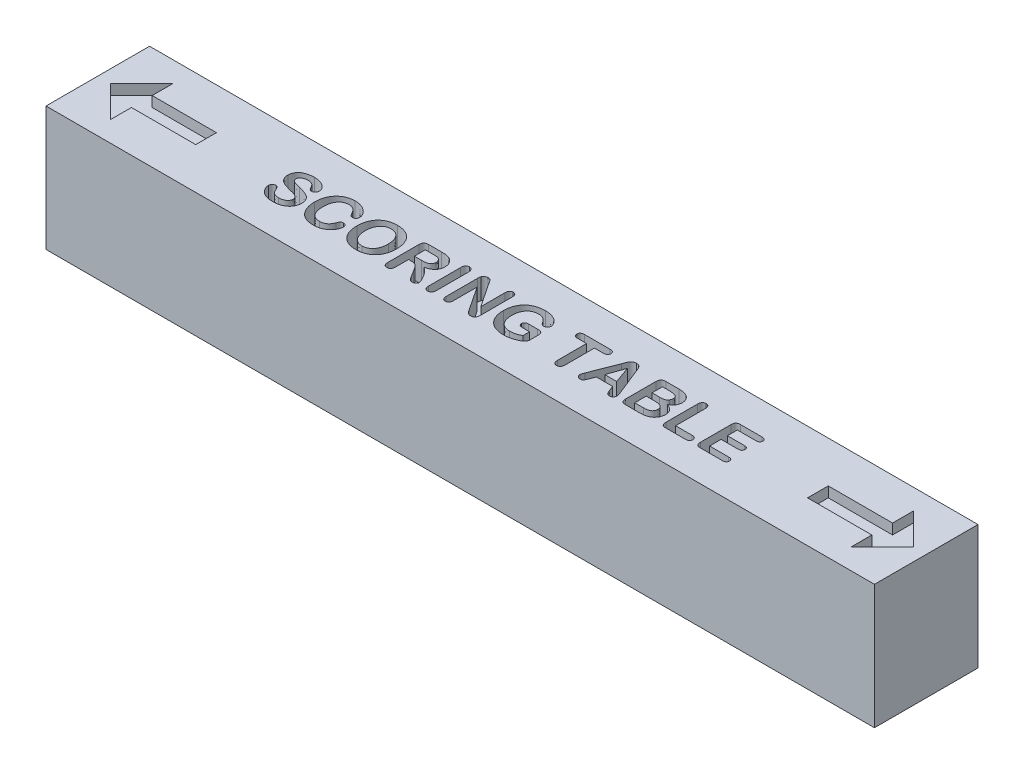
from build123d import *

# Parameters (mm, degrees)
SKETCH1_W           = 6096
SKETCH1_H           = 762
BOSS_EXTRUDE1_DEPTH = 914.4
CUT_EXTRUDE1_DEPTH  = 152.4
CUT_EXTRUDE2_DEPTH  = 76.2


with BuildPart() as part:
    # Sketch1 → Boss-Extrude1 (new body)
    with BuildSketch(Plane(origin=(0, 0, 0), x_dir=(1, 0, 0), z_dir=(0, 1, 0))):
        Rectangle(SKETCH1_W, SKETCH1_H)
    extrude(amount=BOSS_EXTRUDE1_DEPTH)

    # Sketch2 → Cut-Extrude1 (cut)
    # profile 1 of 12: a face of its own
    with BuildSketch(Plane(origin=(0, 914.4, 0), x_dir=(1, 0, 0), z_dir=(0, 1, 0))):
        with BuildLine():
            add(Edge.make_bspline(
                [(-1487.056518555, -60.121112251), (-1487.106101545, -62.390065609), (-1487.204161535, -66.877361336), (-1487.884416786, -73.513910098), (-1488.966104006, -79.968876731), (-1490.455928384, -86.256782548), (-1492.460404312, -92.344775869), (-1494.891754339, -98.268986087), (-1497.683891782, -104.057643313), (-1501.042436703, -109.597594048), (-1504.725550212, -114.935890286), (-1508.876147346, -119.96561222), (-1513.362092894, -124.736522709), (-1518.358376203, -129.133952677), (-1523.701553024, -133.282213676), (-1529.44640812, -137.154974802), (-1535.605669055, -140.704068395), (-1542.155179848, -143.951549975), (-1549.078391402, -146.830093093), (-1556.317213861, -149.346711063), (-1563.853392888, -151.567280221), (-1571.743869654, -153.165352674), (-1579.901538273, -154.616664147), (-1588.408780852, -155.529461745), (-1597.223485866, -156.169642078), (-1603.21151486, -156.22463932), (-1606.242557526, -156.252478027)],
                knots=[0, 0, 0, 0, 0.94904565, 1.876922008, 2.787632434, 3.685409961, 4.577243309, 5.465673456, 6.362823001, 7.262481841, 8.172882791, 9.073480814, 9.987781212, 10.909257821, 11.854472834, 12.815908446, 13.804938933, 14.825933836, 15.871877953, 16.938992789, 18.030809531, 19.155177508, 20.304610591, 21.495671913, 22.732349945, 24, 24, 24, 24], degree=3))
            add(Edge.make_bspline(
                [(-1606.242557526, -156.252478027), (-1609.855253209, -156.184433599), (-1616.948597707, -156.050831821), (-1627.347499347, -155.306444563), (-1637.246749066, -153.884081723), (-1646.692001381, -152.057012172), (-1655.64758092, -149.599092551), (-1664.095686416, -146.553464511), (-1672.122487261, -143.123746698), (-1677.096867585, -140.269478871), (-1679.560029984, -138.856131935)],
                knots=[0, 0, 0, 0, 1.136969792, 2.232382444, 3.278022597, 4.282276305, 5.258039159, 6.196692155, 7.1070566, 8, 8, 8, 8], degree=3))
            add(Edge.make_bspline(
                [(-1679.560029984, -138.856131935), (-1682.752348382, -136.75073427), (-1689.104158979, -132.561588473), (-1697.531716836, -124.815610774), (-1705.200794944, -116.262933255), (-1711.70605, -106.782460892), (-1717.034440691, -96.91527189), (-1720.955479696, -86.989030774), (-1723.370331376, -77.15080032), (-1723.701453991, -70.6074513), (-1723.863527298, -67.404703522)],
                knots=[0, 0, 0, 0, 1.048405233, 2.086029851, 3.131870059, 4.19698972, 5.234628962, 6.204463721, 7.121145791, 8, 8, 8, 8], degree=3))
            add(Edge.make_bspline(
                [(-1723.863527298, -67.404703522), (-1723.771997221, -65.609520864), (-1723.59323326, -62.103416949), (-1722.158540448, -57.067597685), (-1719.809958909, -52.465881566), (-1716.650496166, -48.316773205), (-1712.691215521, -44.893606301), (-1708.143814099, -42.377845068), (-1703.079380081, -40.788879209), (-1699.51665912, -40.636405633), (-1697.678715706, -40.557747269)],
                knots=[0, 0, 0, 0, 1.029346977, 2.010378973, 2.978887221, 3.98112847, 4.985683985, 5.960201932, 6.947705008, 8, 8, 8, 8], degree=3))
            add(Edge.make_bspline(
                [(-1697.678715706, -40.557747269), (-1696.185371322, -40.615741667), (-1693.291226601, -40.728136493), (-1689.136492526, -41.939019956), (-1685.356760741, -43.885545459), (-1681.936539275, -46.629447951), (-1678.781733164, -50.029731756), (-1675.96152068, -54.223993064), (-1673.294432387, -59.083422524), (-1671.874552172, -62.690840666), (-1671.132734299, -64.57553997)],
                knots=[0, 0, 0, 0, 0.932433643, 1.807083439, 2.683354794, 3.577798377, 4.537574086, 5.575745438, 6.73344572, 8, 8, 8, 8], degree=3))
            add(Edge.make_bspline(
                [(-1671.132734299, -64.57553997), (-1670.146705697, -66.85034275), (-1668.243537119, -71.241019821), (-1665.202983078, -77.490499585), (-1661.90390367, -83.069434815), (-1658.628653722, -88.250735802), (-1654.82274405, -92.896590475), (-1650.298748889, -96.983616691), (-1645.150554256, -100.745047376), (-1639.267407594, -104.087897101), (-1632.537660748, -106.849164633), (-1624.814080893, -108.620458967), (-1616.216112392, -109.881549919), (-1610.140501456, -109.974275718), (-1606.964897156, -110.022741699)],
                knots=[0, 0, 0, 0, 1.049400523, 2.025484958, 2.938775158, 3.791458515, 4.617854192, 5.471340711, 6.364831691, 7.311813007, 8.329001391, 9.430967745, 10.65721654, 12, 12, 12, 12], degree=3))
            add(Edge.make_bspline(
                [(-1606.964897156, -110.022741699), (-1604.715946839, -109.995585102), (-1600.309856742, -109.942380542), (-1593.87935511, -109.30671697), (-1587.753780811, -108.38245443), (-1581.99886016, -106.96015024), (-1576.505141631, -105.325627474), (-1571.396747221, -103.114826424), (-1566.568225954, -100.609173348), (-1562.117467268, -97.720606628), (-1558.086431767, -94.537028432), (-1554.526103143, -91.135609354), (-1551.541256632, -87.490198621), (-1549.12700917, -83.65701207), (-1547.143887444, -79.686203507), (-1545.860558315, -75.46984034), (-1544.93857011, -71.096641245), (-1544.875702549, -68.09200346), (-1544.843688965, -66.561973953)],
                knots=[0, 0, 0, 0, 1.280104897, 2.507951138, 3.676307556, 4.80418709, 5.881088807, 6.935759984, 7.968101261, 8.975871649, 9.951925376, 10.889226907, 11.77430911, 12.626938706, 13.464975202, 14.292430499, 15.130466995, 16, 16, 16, 16], degree=3))
            add(Edge.make_bspline(
                [(-1544.843688965, -66.561973953), (-1544.952978111, -64.202111722), (-1545.163649715, -59.65311504), (-1546.961053189, -53.200720418), (-1549.892183072, -47.429210371), (-1554.104675319, -42.492593387), (-1559.152808618, -38.171446869), (-1564.892851072, -34.361952805), (-1571.350519751, -31.187051563), (-1578.543730767, -28.454775266), (-1586.713346077, -26.040250049), (-1595.96395001, -23.410295356), (-1606.507388448, -20.884241296), (-1613.946055641, -19.18154536), (-1617.860186577, -18.285608673)],
                knots=[0, 0, 0, 0, 0.889216893, 1.714102054, 2.506617733, 3.313297162, 4.145346194, 5.008548814, 5.905982136, 6.85524107, 7.90915739, 9.119934543, 10.484546625, 12, 12, 12, 12], degree=3))
            add(Edge.make_bspline(
                [(-1617.860186577, -18.285608673), (-1622.988500488, -17.025984756), (-1632.857980968, -14.601828615), (-1646.903293679, -10.391098261), (-1659.639029147, -5.869918334), (-1671.213064187, -1.121843012), (-1681.566130108, 4.36725648), (-1690.787770249, 10.722309608), (-1698.81344083, 18.054644142), (-1704.651995525, 24.861143489), (-1708.574551827, 30.803675673), (-1711.196298241, 35.51340875), (-1713.353422141, 40.520078507), (-1715.091643768, 45.784779662), (-1716.474505755, 51.277733407), (-1717.509684458, 57.026145451), (-1718.117398296, 63.044580138), (-1718.175596722, 67.149731693), (-1718.205200195, 69.237876511)],
                knots=[0, 0, 0, 0, 1.736501148, 3.341910126, 4.819600125, 6.179978285, 7.452384316, 8.666026066, 9.852526874, 11.018500134, 11.604160195, 12.191898388, 12.788898658, 13.394048862, 14.013423104, 14.650267458, 15.313438986, 16, 16, 16, 16], degree=3))
            add(Edge.make_bspline(
                [(-1718.205200195, 69.237876511), (-1718.183704342, 71.246882416), (-1718.141233304, 75.216232463), (-1717.403541535, 81.079890274), (-1716.455103107, 86.796478425), (-1714.881310226, 92.305764551), (-1713.043949244, 97.673161757), (-1710.757476071, 102.88546051), (-1707.952965829, 107.859762387), (-1704.846858609, 112.704016646), (-1701.269621715, 117.267535744), (-1697.3476866, 121.633139548), (-1693.016693202, 125.717066898), (-1688.3110598, 129.495911365), (-1683.28581882, 133.032508973), (-1677.831837999, 136.21537666), (-1672.006290104, 139.13343857), (-1663.694381978, 142.834899311), (-1652.42426505, 146.517934675), (-1637.952133346, 149.717918606), (-1622.341931598, 151.561769343), (-1611.564632253, 151.815036669), (-1606.001777649, 151.94576416)],
                knots=[0, 0, 0, 0, 0.769447055, 1.520256708, 2.262508943, 2.988321943, 3.713156319, 4.436274914, 5.166110871, 5.89994773, 6.639925254, 7.385953261, 8.147635144, 8.918771606, 9.697541001, 10.500837489, 11.336648996, 12.194084557, 13.986552036, 15.869357873, 17.867910982, 20, 20, 20, 20], degree=3))
            add(Edge.make_bspline(
                [(-1606.001777649, 151.94576416), (-1601.564135532, 151.871310428), (-1592.99066099, 151.727466656), (-1580.593101928, 150.445257203), (-1569.126803001, 148.382911535), (-1558.588917053, 145.437640057), (-1549.003788186, 141.688952849), (-1540.138682813, 137.626534844), (-1532.24253247, 132.75501459), (-1525.180161811, 127.461297573), (-1519.009915252, 121.837359227), (-1513.712219865, 116.009639697), (-1509.276019269, 110.060180243), (-1505.794944047, 103.94398912), (-1503.054557725, 97.858184116), (-1501.113035623, 91.803485572), (-1499.900182201, 85.800137647), (-1499.764438964, 81.803946306), (-1499.697462082, 79.832191086)],
                knots=[0, 0, 0, 0, 1.501690988, 2.90125006, 4.213360721, 5.441058994, 6.597662568, 7.694391675, 8.736870916, 9.731158549, 10.678212085, 11.558107852, 12.393499291, 13.184506524, 13.935459515, 14.648542639, 15.3331793, 16, 16, 16, 16], degree=3))
            add(Edge.make_bspline(
                [(-1499.697462082, 79.832191086), (-1499.79153981, 78.077237785), (-1499.977323597, 74.611572997), (-1501.427251065, 69.557962339), (-1503.81985076, 64.822459558), (-1507.040591437, 60.473265772), (-1510.930043017, 56.745637019), (-1515.450702045, 54.025720738), (-1520.444437015, 52.30601654), (-1523.96208953, 52.118207264), (-1525.761883736, 52.022115326)],
                knots=[0, 0, 0, 0, 0.996822281, 1.968514991, 2.963507279, 3.999520829, 5.032703306, 6.005199511, 6.979367534, 8, 8, 8, 8], degree=3))
            add(Edge.make_bspline(
                [(-1525.761883736, 52.022115326), (-1527.351425255, 52.076907905), (-1530.354760794, 52.180434926), (-1534.562504367, 53.021908521), (-1538.197837434, 54.383062369), (-1541.307483551, 56.431780891), (-1544.064009235, 59.158284468), (-1546.80122299, 62.523946035), (-1549.785419626, 66.475352963), (-1551.630937785, 69.46145264), (-1552.608839989, 71.043725586)],
                knots=[0, 0, 0, 0, 1.091449335, 2.062222683, 2.935356023, 3.742291246, 4.60049062, 5.589116983, 6.722522559, 8, 8, 8, 8], degree=3))
            add(Edge.make_bspline(
                [(-1552.608839989, 71.043725586), (-1554.019462617, 73.941718141), (-1556.741393639, 79.533671423), (-1561.572036442, 87.188685192), (-1566.910371223, 93.76813853), (-1571.68628649, 98.604345497), (-1575.898436429, 101.9326839), (-1579.573943053, 103.963745906), (-1583.660065993, 105.679767736), (-1588.15993293, 107.158734635), (-1593.128522217, 108.205705739), (-1598.538148225, 108.975952644), (-1604.387988793, 109.460341259), (-1608.428689762, 109.531658402), (-1610.516400337, 109.568505859)],
                knots=[0, 0, 0, 0, 1.547925219, 2.986869477, 4.337480217, 5.612327564, 6.244828973, 6.909713596, 7.622436063, 8.372459485, 9.181850378, 10.058552105, 10.996911345, 12, 12, 12, 12], degree=3))
            add(Edge.make_bspline(
                [(-1610.516400337, 109.568505859), (-1614.35593569, 109.441195122), (-1621.683211139, 109.198238422), (-1632.135567578, 107.376564386), (-1641.398225846, 104.10580239), (-1648.19679625, 100.332348984), (-1652.940932463, 96.865309222), (-1655.931024142, 94.085385961), (-1658.532896887, 91.247662687), (-1660.57757773, 88.20457749), (-1662.214860083, 85.055922831), (-1663.47299828, 81.779220696), (-1664.109488447, 78.331847782), (-1664.216808192, 76.001863662), (-1664.270507812, 74.836008644)],
                knots=[0, 0, 0, 0, 1.954508865, 3.729936959, 5.377867423, 6.932763574, 7.670377485, 8.364471239, 9.008409927, 9.626125187, 10.224705099, 10.812996495, 11.406058616, 12, 12, 12, 12], degree=3))
            add(Edge.make_bspline(
                [(-1664.270507812, 74.836008644), (-1664.219461914, 73.405768264), (-1664.119013806, 70.591341569), (-1663.127523761, 66.540752772), (-1661.526347162, 62.788357778), (-1659.341655374, 59.324681575), (-1656.54203552, 56.192412734), (-1653.212834393, 53.384764255), (-1649.576732846, 50.622812012), (-1643.979890675, 47.497967941), (-1636.686749772, 44.083348745), (-1628.873749895, 41.372469676), (-1621.82381463, 39.480388851), (-1615.090375032, 37.759434142), (-1606.922046955, 35.619964451), (-1600.968472841, 34.192392994), (-1597.755066872, 33.42186985)],
                knots=[0, 0, 0, 0, 0.710476229, 1.398074961, 2.059979244, 2.732930957, 3.425942516, 4.140543967, 4.897202213, 5.693324271, 7.323324828, 8.898613798, 9.799484583, 10.954336094, 12.356121149, 14, 14, 14, 14], degree=3))
            add(Edge.make_bspline(
                [(-1597.755066872, 33.42186985), (-1593.657298507, 32.436589934), (-1585.641053265, 30.509139495), (-1573.935503242, 27.373113365), (-1562.825202689, 24.09137322), (-1552.321932609, 20.589013614), (-1542.46602848, 16.944010184), (-1533.388277806, 12.81513379), (-1525.049662767, 8.386781847), (-1517.448353426, 3.514471652), (-1510.652096568, -1.954380927), (-1504.54467406, -7.975219498), (-1499.360934435, -14.79559311), (-1494.928062895, -22.252635908), (-1491.298174818, -30.468491456), (-1488.814983634, -39.594317844), (-1487.292918267, -49.575685221), (-1487.137163106, -56.523683051), (-1487.056518555, -60.121112251)],
                knots=[0, 0, 0, 0, 1.267502217, 2.479546844, 3.644246111, 4.751070339, 5.809111578, 6.802976886, 7.747931384, 8.64678748, 9.513844361, 10.367269951, 11.219414442, 12.082556445, 12.971635876, 13.911644553, 14.918722911, 16, 16, 16, 16], degree=3))
        make_face()
    # profile 2 of 12: a face of its own
    with BuildSketch(Plane(origin=(0, 914.4, 0), x_dir=(1, 0, 0), z_dir=(0, 1, 0))):
        with BuildLine():
            add(Edge.make_bspline(
                [(-1182.530169487, -57.954093361), (-1182.611931916, -60.347578678), (-1182.780748806, -65.289466478), (-1184.200515189, -72.806880437), (-1186.374873209, -80.628279579), (-1189.466556643, -88.662801309), (-1193.392958871, -96.858145341), (-1198.482915274, -104.95973777), (-1204.506602821, -113.024415785), (-1211.519197678, -120.951970372), (-1219.533077421, -128.477176956), (-1228.692600395, -135.276664589), (-1238.867199957, -141.321815818), (-1250.043721381, -146.64696045), (-1262.21556734, -151.025475854), (-1275.453006864, -154.035011207), (-1289.621062941, -155.948813885), (-1299.402253485, -156.149449731), (-1304.424982071, -156.252478027)],
                knots=[0, 0, 0, 0, 0.663733519, 1.370426865, 2.116139696, 2.914458905, 3.756161797, 4.633801399, 5.564768272, 6.546895284, 7.567232022, 8.609557965, 9.705783212, 10.846455846, 12.040496113, 13.287086875, 14.606894913, 16, 16, 16, 16], degree=3))
            add(Edge.make_bspline(
                [(-1304.424982071, -156.252478027), (-1308.259320688, -156.220260155), (-1315.757312667, -156.157258586), (-1326.742944663, -155.254812771), (-1337.217938057, -153.971973918), (-1347.181458873, -152.127189797), (-1356.652088265, -149.63557561), (-1365.660840941, -146.571794646), (-1374.278842099, -142.965514804), (-1382.435833958, -138.675400911), (-1390.211421501, -133.676734765), (-1397.654977244, -128.020786511), (-1404.84298197, -121.680138731), (-1409.224086117, -116.944948758), (-1411.451637268, -114.537364388)],
                knots=[0, 0, 0, 0, 1.162398207, 2.273052359, 3.340187725, 4.361698781, 5.343118899, 6.307107414, 7.245071305, 8.173155143, 9.098082292, 10.044846171, 11.00591152, 12, 12, 12, 12], degree=3))
            add(Edge.make_bspline(
                [(-1411.451637268, -114.537364388), (-1413.386125833, -112.131381842), (-1417.263544764, -107.308917424), (-1422.599325849, -99.634271913), (-1427.356529332, -91.470876975), (-1431.877812201, -83.009850474), (-1435.738019575, -74.085613023), (-1439.18128549, -64.89234659), (-1442.096015273, -55.387884583), (-1444.403488902, -45.56636833), (-1446.317829368, -35.471595892), (-1447.505500022, -25.04754996), (-1448.435311887, -14.369511636), (-1448.499389175, -7.131646922), (-1448.531738281, -3.477646255)],
                knots=[0, 0, 0, 0, 0.929575355, 1.863207229, 2.811429804, 3.773642551, 4.750392879, 5.73698116, 6.729013264, 7.741753443, 8.774044155, 9.821085133, 10.899985467, 12, 12, 12, 12], degree=3))
            add(Edge.make_bspline(
                [(-1448.531738281, -3.477646255), (-1448.413393007, 2.407705428), (-1448.182453151, 13.892424824), (-1446.129703546, 30.621330864), (-1442.946805519, 46.441813542), (-1438.289402506, 61.267244068), (-1432.422782852, 75.124950282), (-1425.476630936, 87.997512827), (-1417.25371303, 99.770827474), (-1407.996929471, 110.487156758), (-1397.73532329, 120.078479517), (-1386.628015816, 128.487625664), (-1374.672117907, 135.634838558), (-1361.957628175, 141.533561794), (-1348.61006334, 146.124775257), (-1334.803321152, 149.54929093), (-1320.556892482, 151.565745175), (-1310.9122464, 151.818398239), (-1306.050246239, 151.94576416)],
                knots=[0, 0, 0, 0, 1.192086909, 2.32624733, 3.409866705, 4.457877143, 5.469000883, 6.455088314, 7.416011801, 8.372962001, 9.319325461, 10.256879636, 11.190511563, 12.136385829, 13.091719595, 14.046248446, 15.015086683, 16, 16, 16, 16], degree=3))
            add(Edge.make_bspline(
                [(-1306.050246239, 151.94576416), (-1303.079547073, 151.894879133), (-1297.211075184, 151.794358233), (-1288.526520293, 151.135255257), (-1280.089689361, 149.981451896), (-1271.891514149, 148.415395514), (-1263.937191785, 146.456524718), (-1256.243815046, 143.957118992), (-1248.801622524, 141.028209205), (-1241.654843394, 137.631951961), (-1234.813350747, 133.993679942), (-1228.380646369, 130.067845586), (-1222.325108023, 125.986374165), (-1216.714449039, 121.621757526), (-1211.480034716, 117.08788332), (-1206.717717924, 112.281196995), (-1202.279548582, 107.362320862), (-1198.359369008, 102.186895593), (-1194.80268742, 97.006205686), (-1191.791539661, 91.790635363), (-1189.213962034, 86.680472204), (-1186.976331298, 81.673284143), (-1185.373667767, 76.677954122), (-1184.228848841, 71.763896568), (-1183.452584495, 66.934830585), (-1183.358981079, 63.722853297), (-1183.312704086, 62.134870148)],
                knots=[0, 0, 0, 0, 1.284700242, 2.537862918, 3.763812693, 4.965289083, 6.145935712, 7.303948861, 8.460888676, 9.602102237, 10.724019168, 11.810373379, 12.859709494, 13.88027226, 14.88267171, 15.852117704, 16.804758353, 17.745428632, 18.657571087, 19.520770973, 20.347343408, 21.132381758, 21.889741149, 22.611674871, 23.313620019, 24, 24, 24, 24], degree=3))
            add(Edge.make_bspline(
                [(-1183.312704086, 62.134870148), (-1183.413945064, 60.462016177), (-1183.61358416, 57.163282206), (-1184.953297149, 52.334955401), (-1187.39700646, 47.918388939), (-1190.532567648, 43.858749343), (-1194.336306412, 40.442132163), (-1198.628766001, 37.919896039), (-1203.326460367, 36.309785449), (-1206.61523057, 36.151319668), (-1208.293616295, 36.070448494)],
                knots=[0, 0, 0, 0, 1.005202555, 1.982178884, 2.979908251, 4.019228851, 5.052378826, 6.030321538, 6.994797445, 8, 8, 8, 8], degree=3))
            add(Edge.make_bspline(
                [(-1208.293616295, 36.070448494), (-1210.104029035, 36.138708979), (-1213.536359118, 36.268122847), (-1218.34566672, 37.251176612), (-1222.434183093, 39.009613609), (-1225.901557811, 41.578015417), (-1228.878927536, 45.123893431), (-1231.987749259, 49.466848434), (-1235.305739166, 54.796199733), (-1237.431783923, 58.75058787), (-1238.571685791, 60.870775795)],
                knots=[0, 0, 0, 0, 1.03602979, 1.964190893, 2.792215287, 3.564084538, 4.410155262, 5.430272824, 6.62221301, 8, 8, 8, 8], degree=3))
            add(Edge.make_bspline(
                [(-1238.571685791, 60.870775795), (-1240.544275823, 64.42756875), (-1244.349797621, 71.289335715), (-1251.061822418, 80.49715841), (-1258.305153832, 88.278212109), (-1266.113866999, 94.70509739), (-1274.725513959, 99.681418982), (-1284.204587977, 103.268543799), (-1294.647930597, 105.300717889), (-1301.888019573, 105.574544899), (-1305.628881454, 105.716027832)],
                knots=[0, 0, 0, 0, 1.14083101, 2.200891824, 3.189077095, 4.117958574, 5.028926365, 5.968284059, 6.950238216, 8, 8, 8, 8], degree=3))
            add(Edge.make_bspline(
                [(-1305.628881454, 105.716027832), (-1308.644872627, 105.649910896), (-1314.569895563, 105.520021802), (-1323.199776903, 104.059395679), (-1331.382249025, 101.885427728), (-1339.063721482, 98.679071382), (-1346.308932687, 94.669092981), (-1353.045314525, 89.667297382), (-1359.273158604, 83.75954253), (-1365.055138641, 77.025321914), (-1370.226195625, 69.436424682), (-1374.672972926, 61.062169296), (-1378.503451084, 51.987956239), (-1381.512260981, 42.10678236), (-1384.032874624, 31.504655059), (-1385.635294323, 20.097846323), (-1386.689851463, 7.979330481), (-1386.823456651, -0.34508534), (-1386.892089844, -4.62135067)],
                knots=[0, 0, 0, 0, 0.93671651, 1.840213212, 2.713397844, 3.56368846, 4.421020421, 5.281885359, 6.164466969, 7.084649485, 8.036264718, 9.013062724, 10.027939462, 11.093339593, 12.220621858, 13.412469407, 14.670781518, 16, 16, 16, 16], degree=3))
            add(Edge.make_bspline(
                [(-1386.892089844, -4.62135067), (-1386.847891584, -7.511067507), (-1386.761597872, -13.153017997), (-1386.365379856, -21.450082963), (-1385.583512518, -29.363229711), (-1384.479164889, -36.907657847), (-1383.197820367, -44.09550142), (-1381.508096087, -50.885831967), (-1379.50169043, -57.31064723), (-1377.257376174, -63.382347594), (-1374.606852869, -69.045903538), (-1371.894847734, -74.425236373), (-1368.821505592, -79.387111009), (-1365.397772386, -83.889474159), (-1361.869743021, -88.154352977), (-1358.01776898, -91.998937185), (-1353.896098857, -95.445584109), (-1348.107971884, -99.54805814), (-1340.26696288, -103.779280466), (-1330.082616501, -107.415353224), (-1319.12809411, -109.637721223), (-1311.558690824, -109.892194391), (-1307.675510406, -110.022741699)],
                knots=[0, 0, 0, 0, 1.161576005, 2.267888061, 3.337585273, 4.356077319, 5.33204537, 6.270922222, 7.166254778, 8.036538097, 8.870177389, 9.678142996, 10.45692397, 11.2117863, 11.950096439, 12.68003429, 13.395618977, 14.107193223, 15.528992878, 16.960094082, 18.440497528, 20, 20, 20, 20], degree=3))
            add(Edge.make_bspline(
                [(-1307.675510406, -110.022741699), (-1305.546449547, -110.000535005), (-1301.35761551, -109.956844306), (-1295.228714082, -109.243159196), (-1289.327362105, -108.245281793), (-1283.700625434, -106.788199543), (-1278.277824727, -105.00898129), (-1273.172647136, -102.681557792), (-1268.262900002, -100.040422335), (-1263.616972046, -96.97271055), (-1259.278673049, -93.448366326), (-1255.181300788, -89.580291254), (-1251.290449445, -85.387236854), (-1247.825655415, -80.69574533), (-1244.546274843, -75.683075222), (-1241.553489956, -70.270230194), (-1238.82461413, -64.483246654), (-1237.299919348, -60.433548346), (-1236.525056839, -58.375458145)],
                knots=[0, 0, 0, 0, 1.080453892, 2.125745732, 3.129130718, 4.117609764, 5.07455133, 6.023212249, 6.962414916, 7.903439618, 8.845456672, 9.796903999, 10.763291339, 11.745501622, 12.754406698, 13.803416246, 14.883677954, 16, 16, 16, 16], degree=3))
            add(Edge.make_bspline(
                [(-1236.525056839, -58.375458145), (-1235.871771157, -56.458430933), (-1234.609742373, -52.755084005), (-1232.321326767, -47.586430706), (-1229.835317966, -42.973302473), (-1227.182792026, -38.821454486), (-1223.808610945, -35.363931262), (-1219.513561135, -32.899957065), (-1214.353629917, -31.538211952), (-1210.669512304, -31.374549626), (-1208.714981079, -31.287722015)],
                knots=[0, 0, 0, 0, 1.148264852, 2.218238262, 3.200956292, 4.119438462, 5.004604087, 5.912235567, 6.892380428, 8, 8, 8, 8], degree=3))
            add(Edge.make_bspline(
                [(-1208.714981079, -31.287722015), (-1206.977672497, -31.374069387), (-1203.56035809, -31.543916078), (-1198.663520989, -33.082238184), (-1194.093935838, -35.434291245), (-1190.139636296, -38.838962125), (-1186.73249814, -42.817607261), (-1184.285647399, -47.439158503), (-1182.782545959, -52.544231823), (-1182.615842655, -56.117630656), (-1182.530169487, -57.954093361)],
                knots=[0, 0, 0, 0, 1.000050397, 1.967115494, 2.935635085, 3.946684534, 4.957733984, 5.941906876, 6.942292355, 8, 8, 8, 8], degree=3))
        make_face()
    # profile 3 of 12: a face of its own
    with BuildSketch(Plane(origin=(0, 914.4, 0), x_dir=(1, 0, 0), z_dir=(0, 1, 0))):
        with BuildLine():
            add(Edge.make_bspline(
                [(-994.962645531, 151.94576416), (-991.148227008, 151.892217238), (-983.668877315, 151.787221901), (-972.659969524, 150.835467638), (-962.042403851, 149.422773268), (-951.823368553, 147.389356897), (-942.028214475, 144.736043657), (-932.655076338, 141.475075589), (-923.691875919, 137.617253841), (-915.128130419, 133.238267492), (-907.057913133, 128.281269497), (-899.429841513, 122.860535773), (-892.330317152, 116.896541046), (-885.742790773, 110.441637198), (-879.709291972, 103.478211779), (-874.142106291, 96.044928617), (-869.084118649, 88.09997421), (-864.589805034, 79.645036778), (-860.551967997, 70.806449966), (-857.046855277, 61.558309175), (-854.121349298, 51.939794572), (-851.687959329, 41.934973265), (-849.843695906, 31.558488381), (-848.544625751, 20.78603813), (-847.645275557, 9.660112402), (-847.578859966, 2.102257759), (-847.545166016, -1.731992149)],
                knots=[0, 0, 0, 0, 1.137132438, 2.22970057, 3.292424762, 4.329649132, 5.333981859, 6.315987487, 7.286185149, 8.241436353, 9.181332131, 10.107725602, 11.0292572, 11.943085262, 12.854854597, 13.773819033, 14.709898734, 15.660115542, 16.626635295, 17.605574315, 18.606712189, 19.622473761, 20.67399022, 21.747038223, 22.857027702, 24, 24, 24, 24], degree=3))
            add(Edge.make_bspline(
                [(-847.545166016, -1.731992149), (-847.662752383, -7.354457421), (-847.893470573, -18.386391143), (-849.643542826, -34.536942116), (-852.610258847, -49.910865802), (-856.650705534, -64.501925927), (-861.961341011, -78.209107389), (-868.42230342, -91.014409208), (-876.097156289, -102.856021739), (-884.903214513, -113.72324017), (-894.806806132, -123.55450603), (-905.875591526, -132.125106221), (-918.040930164, -139.44013082), (-931.19475955, -145.601721724), (-945.415864795, -150.456341963), (-960.675451304, -153.720127501), (-976.879267925, -155.941498573), (-988.032289542, -156.146976523), (-993.758746147, -156.252478027)],
                knots=[0, 0, 0, 0, 1.119700056, 2.196982321, 3.230778928, 4.235358115, 5.208318876, 6.153781848, 7.087131445, 8.013361148, 8.934611457, 9.860297843, 10.794468433, 11.756326826, 12.748403726, 13.780058436, 14.860183413, 16, 16, 16, 16], degree=3))
            add(Edge.make_bspline(
                [(-993.758746147, -156.252478027), (-999.443944213, -156.115602239), (-1010.573751096, -155.847643044), (-1026.798369126, -153.70042), (-1042.139179863, -150.246305319), (-1056.508595386, -145.30756641), (-1069.806243258, -139.018300452), (-1082.087880628, -131.697622246), (-1093.11522916, -123.049532167), (-1103.029933204, -113.320884033), (-1111.831202668, -102.496334006), (-1119.313662658, -90.522231069), (-1125.91258187, -77.659187363), (-1131.128584672, -63.71640759), (-1135.278472127, -48.9963763), (-1138.20323602, -33.608816702), (-1139.986512772, -17.645569828), (-1140.21661374, -6.813100841), (-1140.333496094, -1.310627365)],
                knots=[0, 0, 0, 0, 1.130091603, 2.212359386, 3.247930852, 4.252250901, 5.226719473, 6.16821431, 7.089197795, 8.00610207, 8.925165125, 9.855999165, 10.808795857, 11.79501972, 12.810514548, 13.846493258, 14.906102224, 16, 16, 16, 16], degree=3))
            add(Edge.make_bspline(
                [(-1140.333496094, -1.310627365), (-1140.227471661, 4.293053554), (-1140.018989689, 15.311895237), (-1138.094167138, 31.455603517), (-1135.055137311, 46.911452513), (-1130.723498783, 61.601632481), (-1125.231353615, 75.422944354), (-1118.565043741, 88.224658404), (-1110.846857648, 99.967094088), (-1102.02572108, 110.627903379), (-1092.087625944, 120.142180809), (-1081.088171089, 128.462868703), (-1069.081500009, 135.620423183), (-1056.067060986, 141.507624961), (-1042.104064817, 146.232881211), (-1027.196142983, 149.569054529), (-1011.371323362, 151.590157367), (-1000.526810707, 151.825178275), (-994.962645531, 151.94576416)],
                knots=[0, 0, 0, 0, 1.125218611, 2.212582392, 3.260701818, 4.286054269, 5.284468473, 6.243521648, 7.180287843, 8.101949555, 9.017004541, 9.937572836, 10.866572707, 11.818894766, 12.801573564, 13.82236102, 14.882684417, 16, 16, 16, 16], degree=3))
        make_face()
        with BuildLine():
            add(Edge.make_bspline(
                [(-909.184814453, -1.310627365), (-909.302528385, 4.053366172), (-909.530449838, 14.439300788), (-911.550465473, 29.463319771), (-914.822266949, 43.398837855), (-918.72184612, 54.189135578), (-922.466406756, 62.187412995), (-925.524582162, 67.754237858), (-928.8142787, 72.995138377), (-932.548011634, 77.735506965), (-936.421036866, 82.20147538), (-940.614278092, 86.287731542), (-945.135040009, 89.933432333), (-951.470140084, 94.358411401), (-960.001399053, 98.943467202), (-971.01660554, 102.872379233), (-982.758405655, 105.293530606), (-990.837594731, 105.573223156), (-994.962645531, 105.716027832)],
                knots=[0, 0, 0, 0, 1.663767962, 3.22144036, 4.693807908, 6.09809827, 6.772124886, 7.43249818, 8.068074837, 8.689496673, 9.30272399, 9.901527182, 10.503429657, 11.102750509, 12.297797107, 13.495176895, 14.721094103, 16, 16, 16, 16], degree=3))
            add(Edge.make_bspline(
                [(-994.962645531, 105.716027832), (-997.917478498, 105.642525724), (-1003.757423994, 105.497255819), (-1012.330253276, 104.11764201), (-1020.565266264, 101.960073769), (-1028.424149105, 98.942365726), (-1035.836912069, 95.0885978), (-1042.770393455, 90.409864985), (-1049.14098564, 84.924381499), (-1054.98434748, 78.654360011), (-1060.265559115, 71.536621177), (-1064.950977157, 63.497332262), (-1069.03337129, 54.536385158), (-1072.513768926, 44.73373639), (-1075.266422931, 34.139792844), (-1077.223699343, 22.865626687), (-1078.453257487, 10.976178291), (-1078.612458205, 2.845886496), (-1078.693847656, -1.310627365)],
                knots=[0, 0, 0, 0, 0.926902171, 1.831933723, 2.71800685, 3.595261319, 4.468550136, 5.334998465, 6.214894287, 7.1017058, 8.020008637, 8.99111482, 10.01694856, 11.106630737, 12.25237115, 13.448355624, 14.695502513, 16, 16, 16, 16], degree=3))
            add(Edge.make_bspline(
                [(-1078.693847656, -1.310627365), (-1078.612233531, -5.50719593), (-1078.452562558, -13.717419213), (-1077.225513887, -25.727518173), (-1075.25546064, -37.138549815), (-1072.522463579, -47.903286339), (-1068.986740223, -57.896229786), (-1064.742299631, -67.025814744), (-1059.984092153, -75.357161517), (-1054.370800423, -82.657964349), (-1048.307507672, -89.100567027), (-1041.791258113, -94.712031799), (-1034.869071975, -99.492408553), (-1027.474662356, -103.384095191), (-1019.648566836, -106.304074413), (-1011.477298226, -108.517041692), (-1002.907809213, -109.781026011), (-997.07344507, -109.941503307), (-994.119915962, -110.022741699)],
                knots=[0, 0, 0, 0, 1.300369924, 2.54406124, 3.737115199, 4.88637188, 5.981883645, 7.016846829, 8.003376514, 8.948590554, 9.863559023, 10.741055788, 11.608647785, 12.46534091, 13.323432129, 14.192248925, 15.0848625, 16, 16, 16, 16], degree=3))
            add(Edge.make_bspline(
                [(-994.119915962, -110.022741699), (-990.315836846, -109.895331885), (-982.820509742, -109.644291303), (-971.845368828, -107.300340195), (-961.359373719, -103.615020639), (-953.056739082, -99.371698572), (-946.799248996, -95.1917642), (-942.277364711, -91.665337957), (-938.073602302, -87.652433448), (-934.066650211, -83.307957286), (-930.353683909, -78.537178302), (-926.838264351, -73.400598692), (-923.592564647, -67.843305043), (-920.58972834, -61.896368181), (-917.877960088, -55.570606661), (-915.512670835, -48.882819807), (-913.627110657, -41.803607202), (-911.981444979, -34.398713505), (-910.729508006, -26.619431849), (-909.839257617, -18.503024246), (-909.281458306, -10.026657506), (-909.217529079, -4.261065062), (-909.184814453, -1.310627365)],
                knots=[0, 0, 0, 0, 1.468568495, 2.893578421, 4.316075305, 5.755382189, 6.482330971, 7.222315454, 7.968369796, 8.725783183, 9.504530818, 10.302500265, 11.129737207, 11.9897977, 12.875655565, 13.787998707, 14.728608307, 15.705132475, 16.718642732, 17.771954593, 18.859838044, 20, 20, 20, 20], degree=3))
        make_face(mode=Mode.SUBTRACT)
    # profile 4 of 12: a face of its own
    with BuildSketch(Plane(origin=(0, 914.4, 0), x_dir=(1, 0, 0), z_dir=(0, 1, 0))):
        with BuildLine():
            Line((-714.995843887, -25.268225098), (-735.823303223, -25.268225098))
            Line((-735.823303223, -25.268225098), (-735.823303223, -119.894716644))
            add(Edge.make_bspline(
                [(-735.823303223, -119.894716644), (-735.896631612, -122.81155434), (-736.033833062, -128.269118042), (-737.521404267, -135.869481311), (-740.024822374, -142.279617857), (-743.562365607, -147.465367034), (-747.946254165, -151.394042154), (-752.947726306, -154.238430433), (-758.584618423, -155.979745584), (-762.55745741, -156.15997574), (-764.596498489, -156.252478027)],
                knots=[0, 0, 0, 0, 1.331902197, 2.492062242, 3.520752585, 4.456973203, 5.333663409, 6.188000262, 7.069999586, 8, 8, 8, 8], degree=3))
            add(Edge.make_bspline(
                [(-764.596498489, -156.252478027), (-766.775682223, -156.141889356), (-770.969752357, -155.929049732), (-776.876139861, -154.163009325), (-781.977090529, -151.173292469), (-786.28453777, -147.058842463), (-789.627110502, -141.740794841), (-791.929228096, -135.335711971), (-793.384102632, -127.905116187), (-793.532054585, -122.590980633), (-793.610473633, -119.774326706)],
                knots=[0, 0, 0, 0, 0.98783513, 1.901193439, 2.76656523, 3.649069121, 4.578809423, 5.590416226, 6.722847106, 8, 8, 8, 8], degree=3))
            Line((-793.610473633, -119.774326706), (-793.610473633, 107.582071877))
            add(Edge.make_bspline(
                [(-793.610473633, 107.582071877), (-793.522255334, 110.580463591), (-793.356725434, 116.206546703), (-791.75176481, 123.990077235), (-789.142028396, 130.526137374), (-785.282289486, 135.784030247), (-780.087162396, 139.70828365), (-773.634108009, 142.388105188), (-765.917626937, 143.988768878), (-760.351250553, 144.152961182), (-757.373102188, 144.240808105)],
                knots=[0, 0, 0, 0, 1.204539147, 2.260157444, 3.178834964, 4.014831347, 4.849268471, 5.763683293, 6.803515522, 8, 8, 8, 8], degree=3))
            Line((-757.373102188, 144.240808105), (-661.301931381, 144.240808105))
            add(Edge.make_bspline(
                [(-661.301931381, 144.240808105), (-658.111538704, 144.211578912), (-651.970065411, 144.155313014), (-643.093505278, 143.898812566), (-634.945852685, 143.27254993), (-627.431726895, 142.506343919), (-620.452302319, 141.479891567), (-613.909280236, 139.86254662), (-607.675298532, 137.940814639), (-603.760556284, 136.193803358), (-601.829301834, 135.331952667)],
                knots=[0, 0, 0, 0, 1.26312999, 2.431512321, 3.514756431, 4.497259456, 5.421894158, 6.30431173, 7.16346842, 8, 8, 8, 8], degree=3))
            add(Edge.make_bspline(
                [(-601.829301834, 135.331952667), (-599.518392603, 134.294628309), (-594.923379417, 132.232011984), (-588.442258892, 128.312309468), (-582.355910335, 123.817650002), (-576.763517346, 118.662509314), (-571.621748962, 113.061866381), (-567.239584945, 106.85020569), (-563.412742578, 100.279576161), (-560.285059876, 93.27087681), (-557.848391428, 85.944059521), (-555.99291115, 78.38444481), (-554.982964712, 70.589716328), (-554.832598446, 65.32783836), (-554.756835938, 62.67662487)],
                knots=[0, 0, 0, 0, 0.991101386, 1.970706541, 2.959125982, 3.949043219, 4.94477413, 5.930285116, 6.919453739, 7.918248778, 8.929482208, 9.939493973, 10.961807665, 12, 12, 12, 12], degree=3))
            add(Edge.make_bspline(
                [(-554.756835938, 62.67662487), (-554.810425533, 59.985085896), (-554.915122736, 54.726665841), (-555.853861654, 47.059436485), (-557.28350221, 39.785258852), (-559.288294092, 32.901691414), (-562.062950791, 26.485293207), (-565.282098998, 20.452976423), (-569.128261682, 14.834498257), (-573.593812283, 9.650997687), (-578.694168004, 4.895093658), (-584.350010049, 0.461085338), (-590.600043006, -3.631453563), (-597.510251176, -7.287071151), (-605.008098022, -10.620547268), (-613.140160724, -13.506068575), (-621.8305294, -16.230083846), (-627.902066046, -17.587610546), (-631.023861885, -18.285608673)],
                knots=[0, 0, 0, 0, 1.055142993, 2.061417327, 3.024364171, 3.960444909, 4.866579139, 5.760848635, 6.638237999, 7.530982974, 8.438346324, 9.368654669, 10.346405169, 11.363786046, 12.431180916, 13.561267985, 14.746079633, 16, 16, 16, 16], degree=3))
            add(Edge.make_bspline(
                [(-631.023861885, -18.285608673), (-628.317452661, -19.791398262), (-622.798944704, -22.861780875), (-615.032937383, -28.723521808), (-607.35888981, -35.440021031), (-600.076822165, -43.223181736), (-593.00145961, -51.521455557), (-586.16785239, -60.122170774), (-579.794645557, -69.031776588), (-573.920869057, -78.112812943), (-568.487268944, -87.038031174), (-563.652021946, -95.643481211), (-559.506793024, -103.832582168), (-555.984385805, -111.437893056), (-553.178593271, -118.225704786), (-551.179622607, -123.970772389), (-549.836632823, -128.525195067), (-549.570792238, -131.226153606), (-549.45967865, -132.355075264)],
                knots=[0, 0, 0, 0, 1.03513849, 2.110700756, 3.247524223, 4.444168505, 5.672631725, 6.896242247, 8.11841533, 9.33624741, 10.514118669, 11.614189172, 12.638032039, 13.584270828, 14.418327787, 15.09350525, 15.621111712, 16, 16, 16, 16], degree=3))
            add(Edge.make_bspline(
                [(-549.45967865, -132.355075264), (-549.665128982, -134.31157848), (-550.096218282, -138.416841275), (-552.594750503, -143.145782505), (-555.238248215, -146.654515472), (-557.613143148, -149.126532937), (-560.404885699, -151.202458385), (-563.479985023, -153.026979324), (-566.856052969, -154.477643422), (-570.523874189, -155.480552926), (-574.433471269, -156.18858764), (-577.146017391, -156.230853412), (-578.533848763, -156.252478027)],
                knots=[0, 0, 0, 0, 1.406975553, 2.952207972, 3.767564478, 4.575194754, 5.410805362, 6.266190622, 7.146975177, 8.048514508, 9.001553276, 10, 10, 10, 10], degree=3))
            add(Edge.make_bspline(
                [(-578.533848763, -156.252478027), (-580.164501558, -156.201790279), (-583.312296091, -156.103943197), (-587.821067345, -155.150726558), (-591.972257809, -153.749153893), (-596.891010699, -150.935070784), (-602.313995621, -146.329640297), (-606.908915054, -140.649306696), (-610.452830852, -135.280535962), (-613.541403009, -130.344903377), (-617.200415187, -124.628112593), (-619.697731235, -120.483177892), (-621.031497002, -118.269452477)],
                knots=[0, 0, 0, 0, 0.811939239, 1.567358733, 2.288822191, 2.987519458, 4.379962622, 5.808282274, 6.615771143, 7.58722562, 8.711386222, 10, 10, 10, 10], degree=3))
            Line((-621.031497002, -118.269452477), (-645.229874611, -78.48057785))
            add(Edge.make_bspline(
                [(-645.229874611, -78.48057785), (-647.293059116, -75.035038217), (-651.194671332, -68.519305143), (-657.077062162, -59.51282599), (-662.679427193, -51.85043431), (-667.945237784, -45.361748243), (-673.062214517, -39.949245265), (-678.167583417, -35.493183019), (-683.395102719, -32.044486683), (-688.710254247, -29.336305254), (-694.421420698, -27.463760091), (-700.677940379, -26.154225279), (-707.61246666, -25.378851368), (-712.465599471, -25.306136137), (-714.995843887, -25.268225098)],
                knots=[0, 0, 0, 0, 1.54923933, 2.929709427, 4.148172657, 5.209662816, 6.151357592, 7.018659628, 7.817301611, 8.561575462, 9.313059885, 10.128334294, 11.024182546, 12, 12, 12, 12], degree=3))
        make_face()
        with BuildLine():
            Line((-680.925491333, 98.011071777), (-735.823303223, 98.011071777))
            Line((-735.823303223, 98.011071777), (-735.823303223, 17.109033203))
            Line((-735.823303223, 17.109033203), (-682.550755501, 17.109033203))
            add(Edge.make_bspline(
                [(-682.550755501, 17.109033203), (-679.118690167, 17.158225093), (-672.508670123, 17.252966696), (-663.039220651, 17.884986921), (-654.409395585, 19.020969324), (-646.647399685, 20.608494961), (-639.664453589, 22.71154091), (-633.627899931, 25.650964382), (-628.313616592, 29.052679422), (-623.966896047, 33.292375139), (-620.472129476, 38.284695554), (-618.105647394, 44.170984899), (-616.631425616, 50.846266311), (-616.477345442, 55.565148998), (-616.396484375, 58.041612244)],
                knots=[0, 0, 0, 0, 1.392051732, 2.681035748, 3.846991481, 4.919597892, 5.892539963, 6.795281946, 7.634960986, 8.440706374, 9.24212453, 10.088520951, 10.996858383, 12, 12, 12, 12], degree=3))
            add(Edge.make_bspline(
                [(-616.396484375, 58.041612244), (-616.451514467, 60.035104161), (-616.559324535, 63.940576486), (-617.82602221, 69.570735624), (-619.760283894, 74.853570173), (-622.48266237, 79.709639443), (-625.846386364, 84.155570455), (-629.935311793, 87.938026277), (-634.562353979, 91.232995561), (-638.035537824, 92.810056239), (-639.812327385, 93.616839027)],
                knots=[0, 0, 0, 0, 1.054557985, 2.06599635, 3.041648879, 4.026871944, 5.005128146, 5.982979788, 6.968145478, 8, 8, 8, 8], degree=3))
            add(Edge.make_bspline(
                [(-639.812327385, 93.616839027), (-640.790233016, 93.974268866), (-642.915957925, 94.751232907), (-646.502738865, 95.640443713), (-650.718785333, 96.304046958), (-655.527909942, 96.999455525), (-660.973757217, 97.464767813), (-667.059250209, 97.718489542), (-673.779906326, 98.003962563), (-678.477188623, 98.008635936), (-680.925491333, 98.011071777)],
                knots=[0, 0, 0, 0, 0.601274756, 1.307022564, 2.130372336, 3.066540635, 4.11402688, 5.286356465, 6.585603249, 8, 8, 8, 8], degree=3))
        make_face(mode=Mode.SUBTRACT)
    # profile 5 of 12: a face of its own
    with BuildSketch(Plane(origin=(0, 914.4, 0), x_dir=(1, 0, 0), z_dir=(0, 1, 0))):
        with BuildLine():
            Line((-493.1171875, -119.47335186), (-493.1171875, 115.3472229))
            add(Edge.make_bspline(
                [(-493.1171875, 115.3472229), (-493.046699659, 118.225503872), (-492.914439339, 123.626185188), (-491.376908639, 131.157409341), (-488.998066013, 137.629889401), (-485.395233958, 142.846938355), (-481.103506138, 146.97330202), (-476.068208437, 149.845693263), (-470.490253382, 151.69234839), (-466.54598591, 151.859896802), (-464.524577141, 151.94576416)],
                knots=[0, 0, 0, 0, 1.314663, 2.466776515, 3.501452278, 4.446007437, 5.34208644, 6.201692853, 7.078380494, 8, 8, 8, 8], degree=3))
            add(Edge.make_bspline(
                [(-464.524577141, 151.94576416), (-462.443096907, 151.861618507), (-458.400440787, 151.698190608), (-452.684349317, 149.847398469), (-447.558125651, 146.991721423), (-443.153445726, 142.912243063), (-439.533937133, 137.70575082), (-437.03058596, 131.259386842), (-435.54360559, 123.68195911), (-435.404254893, 118.244160243), (-435.33001709, 115.3472229)],
                knots=[0, 0, 0, 0, 0.939704012, 1.825095485, 2.692007845, 3.579728686, 4.520135675, 5.539530793, 6.689207656, 8, 8, 8, 8], degree=3))
            Line((-435.33001709, 115.3472229), (-435.33001709, -119.47335186))
            add(Edge.make_bspline(
                [(-435.33001709, -119.47335186), (-435.403661962, -122.370351231), (-435.541899677, -127.808266532), (-437.039791309, -135.403292834), (-439.536934358, -141.883849422), (-443.130543827, -147.15970158), (-447.579152765, -151.219844863), (-452.653442418, -154.188114486), (-458.418209302, -155.906387391), (-462.446545772, -156.134701435), (-464.524577141, -156.252478027)],
                knots=[0, 0, 0, 0, 1.307751878, 2.454761992, 3.480206064, 4.425894871, 5.311556588, 6.180961951, 7.061642901, 8, 8, 8, 8], degree=3))
            add(Edge.make_bspline(
                [(-464.524577141, -156.252478027), (-466.522252474, -156.132827233), (-470.412226337, -155.899837188), (-475.985784512, -154.189616019), (-480.915336333, -151.16548149), (-485.293811829, -147.101727031), (-488.947437087, -141.82633967), (-491.28688735, -135.291785883), (-492.939885029, -127.761889183), (-493.055576519, -122.353542462), (-493.1171875, -119.47335186)],
                knots=[0, 0, 0, 0, 0.912572231, 1.777006537, 2.632638816, 3.534642503, 4.491136576, 5.533474522, 6.686463005, 8, 8, 8, 8], degree=3))
        make_face()
    # profile 6 of 12: a face of its own
    with BuildSketch(Plane(origin=(0, 914.4, 0), x_dir=(1, 0, 0), z_dir=(0, 1, 0))):
        with BuildLine():
            Line((-286.648443222, 115.768587685), (-169.509033203, -59.940527344))
            Line((-169.509033203, -59.940527344), (-169.509033203, 117.393851852))
            add(Edge.make_bspline(
                [(-169.509033203, 117.393851852), (-169.418602354, 120.108258119), (-169.249221346, 125.192461991), (-167.962432479, 132.320995905), (-165.707705633, 138.367996849), (-162.51259542, 143.333800425), (-158.540105865, 147.217705592), (-153.849631112, 149.976870019), (-148.5334258, 151.667770977), (-144.781694818, 151.851042617), (-142.842661858, 151.94576416)],
                knots=[0, 0, 0, 0, 1.319117216, 2.470765316, 3.505116792, 4.43580569, 5.318756254, 6.18027265, 7.059497782, 8, 8, 8, 8], degree=3))
            add(Edge.make_bspline(
                [(-142.842661858, 151.94576416), (-140.84463148, 151.849263969), (-136.977263613, 151.662479153), (-131.50809155, 150.00599727), (-126.728016172, 147.218194379), (-122.692663975, 143.339499932), (-119.439309993, 138.373525981), (-117.105410806, 132.333917461), (-115.83928904, 125.190712612), (-115.666559446, 120.107649226), (-115.57434082, 117.393851852)],
                knots=[0, 0, 0, 0, 0.959871134, 1.857917088, 2.719075999, 3.600089629, 4.526699118, 5.554128738, 6.694173474, 8, 8, 8, 8], degree=3))
            Line((-115.57434082, 117.393851852), (-115.57434082, -117.005358124))
            add(Edge.make_bspline(
                [(-115.57434082, -117.005358124), (-115.648701491, -120.082137335), (-115.788267864, -125.856895798), (-117.275190017, -133.931520212), (-119.782779127, -140.804519193), (-123.291277255, -146.507102757), (-127.908971033, -150.981111783), (-133.617586671, -154.056316739), (-140.273427428, -155.976994693), (-145.035654823, -156.157588643), (-147.537869453, -156.252478027)],
                knots=[0, 0, 0, 0, 1.276164049, 2.395212213, 3.391561633, 4.297456637, 5.151673506, 6.027862746, 6.963780962, 8, 8, 8, 8], degree=3))
            add(Edge.make_bspline(
                [(-147.537869453, -156.252478027), (-150.074724748, -156.133449435), (-154.967639674, -155.903875137), (-162.01639162, -154.227777665), (-168.425279571, -151.100838548), (-174.183789972, -146.579478336), (-179.574670727, -141.095832966), (-184.509164586, -134.735323451), (-189.158163187, -127.84428087), (-192.340024307, -123.203410477), (-193.948190689, -120.857836151)],
                knots=[0, 0, 0, 0, 0.990229924, 1.909888509, 2.806876858, 3.75171819, 4.754420985, 5.802993103, 6.889595585, 8, 8, 8, 8], degree=3))
            Line((-193.948190689, -120.857836151), (-308.198242188, 51.781335449))
            Line((-308.198242188, 51.781335449), (-308.198242188, -121.881150627))
            add(Edge.make_bspline(
                [(-308.198242188, -121.881150627), (-308.288463684, -124.535106097), (-308.459366164, -129.562373347), (-309.778976122, -136.631576192), (-312.206581251, -142.667500108), (-315.541930194, -147.631217847), (-319.63774395, -151.493320996), (-324.320143849, -154.27376317), (-329.57452786, -155.969448242), (-333.266747445, -156.156355201), (-335.165588379, -156.252478027)],
                knots=[0, 0, 0, 0, 1.293064309, 2.449392962, 3.484384031, 4.441729672, 5.340986808, 6.204611779, 7.076664708, 8, 8, 8, 8], degree=3))
            add(Edge.make_bspline(
                [(-335.165588379, -156.252478027), (-337.1047784, -156.159952822), (-340.882072898, -155.979725538), (-346.228885349, -154.237788456), (-350.931471833, -151.363036952), (-355.038184263, -147.479130455), (-358.233596074, -142.421785822), (-360.515937637, -136.385578966), (-361.886746026, -129.36568789), (-362.047654925, -124.355761955), (-362.13293457, -121.70056572)],
                knots=[0, 0, 0, 0, 0.938889884, 1.828837584, 2.693878765, 3.596100726, 4.546832571, 5.570326044, 6.712304089, 8, 8, 8, 8], degree=3))
            Line((-362.13293457, -121.70056572), (-362.13293457, 108.244216537))
            add(Edge.make_bspline(
                [(-362.13293457, 108.244216537), (-362.110351298, 110.553885506), (-362.067648458, 114.921251978), (-361.436036786, 121.070804293), (-360.572940105, 126.482998613), (-359.503030261, 129.723571672), (-359.002796173, 131.238694763)],
                knots=[0, 0, 0, 0, 1.18793306, 2.246269525, 3.180047019, 4, 4, 4, 4], degree=3))
            add(Edge.make_bspline(
                [(-359.002796173, 131.238694763), (-358.331547417, 132.712974229), (-356.991436667, 135.65629106), (-354.052887996, 139.556300067), (-350.698959445, 143.191117247), (-346.651356514, 146.18565673), (-342.284099819, 148.730715231), (-337.652387351, 150.611728173), (-332.811581696, 151.740924483), (-329.53318848, 151.877151988), (-327.881997108, 151.94576416)],
                knots=[0, 0, 0, 0, 0.980600708, 1.957714689, 2.948627098, 3.97434472, 5.000279326, 6.011426356, 6.998437519, 8, 8, 8, 8], degree=3))
            add(Edge.make_bspline(
                [(-327.881997108, 151.94576416), (-325.414637251, 151.847601669), (-320.787886835, 151.663529069), (-314.408170543, 149.532708053), (-308.977144978, 146.409114822), (-304.280633527, 142.145526574), (-299.839959486, 136.876287206), (-295.724266189, 130.380134406), (-291.267451242, 123.24355714), (-288.211598011, 118.298250817), (-286.648443222, 115.768587685)],
                knots=[0, 0, 0, 0, 1.01695463, 1.906975685, 2.751376853, 3.592506721, 4.517315556, 5.594915983, 6.76973195, 8, 8, 8, 8], degree=3))
        make_face()
    # profile 7 of 12: a face of its own
    with BuildSketch(Plane(origin=(0, 914.4, 0), x_dir=(1, 0, 0), z_dir=(0, 1, 0))):
        with BuildLine():
            Line((223.443725586, -30.505187416), (223.443725586, -87.509823227))
            add(Edge.make_bspline(
                [(223.443725586, -87.509823227), (223.430353359, -89.316877644), (223.405052238, -92.735941955), (222.960489925, -97.57881748), (222.347120266, -101.857199778), (221.376398155, -105.640621737), (220.01673341, -109.036084163), (218.249796677, -112.236132598), (215.942515942, -115.221468484), (212.180128875, -119.110337237), (206.356656955, -123.746961503), (201.095435738, -126.845688759), (198.28222847, -128.502597237)],
                knots=[0, 0, 0, 0, 1.05167989, 1.989846651, 2.829196185, 3.565931773, 4.257962754, 4.953534565, 5.687207176, 6.447374645, 8.100389424, 10, 10, 10, 10], degree=3))
            add(Edge.make_bspline(
                [(198.28222847, -128.502597237), (193.833076931, -130.802504969), (185.104367989, -135.314651839), (171.855936334, -141.0485969), (158.89998912, -145.929129215), (146.02878219, -149.774560681), (133.015970965, -152.697628845), (119.5576238, -154.717556823), (105.567621628, -156.022277268), (96.034004947, -156.174977563), (91.195378304, -156.252478027)],
                knots=[0, 0, 0, 0, 1.07439078, 2.1078276, 3.0954898, 4.043555579, 4.987801064, 5.954741935, 6.961963702, 8, 8, 8, 8], degree=3))
            add(Edge.make_bspline(
                [(91.195378304, -156.252478027), (85.57070055, -156.132164914), (74.5259238, -155.895914673), (58.359587697, -153.83618402), (42.920877025, -150.652543075), (28.332913739, -145.991780002), (14.625796739, -140.111646507), (1.927755211, -132.968238639), (-9.781665992, -124.709280651), (-20.357220993, -115.188733649), (-29.853812775, -104.571666449), (-38.1364587, -92.795430535), (-45.244810593, -79.96881902), (-51.214183216, -66.146551825), (-55.925894708, -51.372155845), (-59.164776258, -35.692889509), (-61.30361518, -19.207303032), (-61.526041742, -7.918984073), (-61.639648437, -2.153356934)],
                knots=[0, 0, 0, 0, 1.100386502, 2.160750142, 3.184321939, 4.181582475, 5.152517567, 6.098441418, 7.027870255, 7.951106382, 8.87726923, 9.809903018, 10.762681596, 11.742383864, 12.752061269, 13.791813684, 14.872145711, 16, 16, 16, 16], degree=3))
            add(Edge.make_bspline(
                [(-61.639648437, -2.153356934), (-61.512682709, 3.530549044), (-61.263827849, 14.671095701), (-59.303291469, 31.008002966), (-56.070940943, 46.606378207), (-51.506373433, 61.426176299), (-45.685438934, 75.352399411), (-38.638931722, 88.252384078), (-30.326301944, 100.015854138), (-20.83886387, 110.686082803), (-10.112533564, 120.148245029), (1.688731477, 128.527296838), (14.637960567, 135.615215542), (28.634278025, 141.535961192), (43.631650466, 146.21638424), (59.629228368, 149.587582446), (76.597327127, 151.58449789), (88.240378945, 151.823383042), (94.205126762, 151.94576416)],
                knots=[0, 0, 0, 0, 1.098578105, 2.153230663, 3.175691274, 4.174419311, 5.14625478, 6.088916885, 7.010162605, 7.925016398, 8.842768463, 9.769420772, 10.717351455, 11.690695295, 12.702839522, 13.749673472, 14.847155329, 16, 16, 16, 16], degree=3))
            add(Edge.make_bspline(
                [(94.205126762, 151.94576416), (99.084981795, 151.862987448), (108.58836594, 151.701782067), (122.42093692, 150.17218988), (135.392774105, 147.673027279), (147.448583901, 144.183403916), (158.47623788, 139.887694339), (168.552652858, 135.177571533), (177.490578589, 129.831110223), (185.281511165, 123.932570805), (192.132369866, 117.7878316), (198.01816285, 111.374573936), (203.176102261, 104.889937582), (207.214253832, 98.163638421), (210.356982608, 91.582555758), (212.825239896, 85.367286263), (214.183914114, 79.428984988), (214.421639718, 75.583927814), (214.534870148, 73.752499199)],
                knots=[0, 0, 0, 0, 1.493654161, 2.908850607, 4.254647133, 5.533949551, 6.745570033, 7.874969631, 8.935929066, 9.927474038, 10.862663671, 11.749528455, 12.590074434, 13.395023508, 14.145147076, 14.821757919, 15.438794752, 16, 16, 16, 16], degree=3))
            add(Edge.make_bspline(
                [(214.534870148, 73.752499199), (214.42561409, 71.91654733), (214.211645339, 68.320990846), (212.667407006, 63.127128584), (209.99995117, 58.412782759), (206.399153233, 54.247717019), (202.100105181, 50.766028251), (197.286438397, 48.195324072), (192.02086774, 46.601333813), (188.361432441, 46.444334398), (186.484014511, 46.363788223)],
                knots=[0, 0, 0, 0, 1.011347772, 1.98063909, 2.956031586, 3.97569046, 4.998224318, 5.987747808, 6.967644449, 8, 8, 8, 8], degree=3))
            add(Edge.make_bspline(
                [(186.484014511, 46.363788223), (184.376556311, 46.52141525), (180.118061196, 46.839928766), (174.061982199, 49.233472311), (168.599101573, 52.966171081), (165.803133592, 56.379601189), (164.392460823, 58.101807213)],
                knots=[0, 0, 0, 0, 0.973372159, 1.966872028, 2.974209188, 4, 4, 4, 4], degree=3))
            add(Edge.make_bspline(
                [(164.392460823, 58.101807213), (162.606400811, 60.864052948), (159.248394746, 66.057404723), (154.217197963, 73.181261341), (149.67842276, 79.27607292), (145.40436547, 84.458259731), (141.083826954, 89.039260273), (136.049759304, 92.915067781), (130.460551501, 96.554609956), (124.131534413, 99.750139134), (117.056275824, 102.530053747), (109.013598627, 104.402092166), (100.077556191, 105.547207232), (93.807660011, 105.658109565), (90.533233643, 105.716027832)],
                knots=[0, 0, 0, 0, 1.270284042, 2.388285663, 3.367826865, 4.204273144, 4.982473651, 5.793364349, 6.651044596, 7.555617024, 8.527062579, 9.579629544, 10.735971918, 12, 12, 12, 12], degree=3))
            add(Edge.make_bspline(
                [(90.533233643, 105.716027832), (87.098299693, 105.616178233), (80.382935863, 105.420970292), (70.588085963, 104.113034938), (61.369222718, 101.808888091), (52.727676516, 98.619210094), (44.684491233, 94.558893988), (37.211050502, 89.724655911), (30.36954684, 84.018507348), (24.150083045, 77.493957911), (18.615086944, 70.16379324), (13.676433771, 62.10507102), (9.562629235, 53.193737263), (6.069512969, 43.595239904), (3.394453835, 33.309231091), (1.393167655, 22.491247222), (0.261167419, 11.093442413), (0.088419356, 3.326796689), (0, -0.648482704)],
                knots=[0, 0, 0, 0, 1.044628969, 2.042270301, 2.998361366, 3.928992089, 4.837758762, 5.733129983, 6.630080197, 7.540791152, 8.468355801, 9.418625922, 10.40956343, 11.448096838, 12.521211322, 13.637926174, 14.790996301, 16, 16, 16, 16], degree=3))
            add(Edge.make_bspline(
                [(0, -0.648482704), (0.061554272, -4.904829217), (0.181416717, -13.193061418), (1.333086203, -25.246118299), (3.252385907, -36.531566459), (5.873870291, -47.078600265), (9.323559798, -56.86233254), (13.451645066, -65.946781358), (18.409595373, -74.252278511), (24.140382864, -81.733465912), (30.552686543, -88.385314803), (37.559858392, -94.210120561), (45.200976709, -99.122527969), (53.460905146, -103.100378076), (62.276677251, -106.242680044), (71.701559738, -108.465290794), (81.725692867, -109.809087272), (88.622765504, -109.950333093), (92.15849781, -110.022741699)],
                knots=[0, 0, 0, 0, 1.258141377, 2.449933962, 3.575390538, 4.640093752, 5.658870901, 6.638339712, 7.585514639, 8.512181286, 9.418399795, 10.311632542, 11.200223959, 12.096995521, 13.016399166, 13.961733165, 14.955097869, 16, 16, 16, 16], degree=3))
            add(Edge.make_bspline(
                [(92.15849781, -110.022741699), (95.632486777, -109.951999607), (102.475284647, -109.812657242), (112.570063129, -108.749627006), (122.359351598, -107.103249487), (131.870935935, -104.631465503), (141.268669266, -101.593160185), (150.66908634, -97.96735345), (160.125142948, -93.752739028), (166.352772961, -90.568383598), (169.509033203, -88.954502487)],
                knots=[0, 0, 0, 0, 1.028897666, 2.026643961, 3.003818171, 3.966807385, 4.934846124, 5.928298728, 6.95002941, 8, 8, 8, 8], degree=3))
            Line((169.509033203, -88.954502487), (169.509033203, -40.678137207))
            Line((169.509033203, -40.678137207), (122.316177368, -40.678137207))
            add(Edge.make_bspline(
                [(122.316177368, -40.678137207), (119.642364672, -40.645102994), (114.633134001, -40.58321534), (107.644350704, -39.4965399), (101.619790176, -38.047453444), (96.586910109, -35.774327623), (92.618116665, -32.609488278), (89.706846929, -28.533279496), (88.087303704, -23.455568444), (87.915550992, -19.801970317), (87.82446003, -17.864243889)],
                knots=[0, 0, 0, 0, 1.358690867, 2.545427349, 3.590341975, 4.503704112, 5.331160324, 6.144067978, 7.015685797, 8, 8, 8, 8], degree=3))
            add(Edge.make_bspline(
                [(87.82446003, -17.864243889), (87.886874996, -16.226862359), (88.008047379, -13.048050709), (89.492711523, -8.548099603), (91.752438642, -4.476972102), (94.904757992, -0.912412512), (98.865347638, 1.991843448), (103.521492742, 4.140577618), (108.855717959, 5.315025282), (112.599184278, 5.470522779), (114.551026344, 5.551599121)],
                knots=[0, 0, 0, 0, 0.980805911, 1.904136086, 2.816924439, 3.765675331, 4.740453241, 5.749851111, 6.826773133, 8, 8, 8, 8], degree=3))
            Line((114.551026344, 5.551599121), (182.751926422, 5.551599121))
            add(Edge.make_bspline(
                [(182.751926422, 5.551599121), (184.759111509, 5.534064443), (188.637884724, 5.500179655), (194.208409423, 5.087154941), (199.297232421, 4.367203403), (203.937906206, 3.382499878), (208.178837785, 1.898865145), (211.992805651, -0.305813321), (215.345288547, -3.263104728), (218.275386797, -6.925306139), (220.688523, -11.449021535), (222.322919652, -16.945144935), (223.239701988, -23.411568507), (223.372649995, -28.033987226), (223.443725586, -30.505187416)],
                knots=[0, 0, 0, 0, 1.134119292, 2.191622269, 3.153761991, 4.036816067, 4.868972684, 5.681903256, 6.509644808, 7.380899382, 8.319362442, 9.38811255, 10.603653811, 12, 12, 12, 12], degree=3))
        make_face()
    # profile 8 of 12: a face of its own
    with BuildSketch(Plane(origin=(0, 914.4, 0), x_dir=(1, 0, 0), z_dir=(0, 1, 0))):
        with BuildLine():
            Line((578.172678947, 94.15859375), (512.379577637, 94.15859375))
            Line((512.379577637, 94.15859375), (512.379577637, -119.894716644))
            add(Edge.make_bspline(
                [(512.379577637, -119.894716644), (512.308256049, -122.792331741), (512.17486403, -128.211710885), (510.657063949, -135.780219388), (508.198782667, -142.210498713), (504.618749369, -147.401874128), (500.279108528, -151.399562544), (495.267866528, -154.221392379), (489.662139585, -155.988968287), (485.70660885, -156.162817016), (483.666577339, -156.252478027)],
                knots=[0, 0, 0, 0, 1.324771526, 2.4777063, 3.516495944, 4.454151167, 5.338361256, 6.19400724, 7.068574513, 8, 8, 8, 8], degree=3))
            add(Edge.make_bspline(
                [(483.666577339, -156.252478027), (481.603775041, -156.170627393), (477.59770976, -156.011669367), (471.950285528, -154.126612671), (466.801466183, -151.371467285), (462.424312205, -147.27168991), (458.777199736, -142.088533488), (456.399698965, -135.620342167), (454.778383104, -128.141541442), (454.656894054, -122.754289483), (454.592407227, -119.894716644)],
                knots=[0, 0, 0, 0, 0.936591527, 1.818907611, 2.686883908, 3.580272073, 4.52668274, 5.549195867, 6.699104295, 8, 8, 8, 8], degree=3))
            Line((454.592407227, -119.894716644), (454.592407227, 94.15859375))
            Line((454.592407227, 94.15859375), (388.739110947, 94.15859375))
            add(Edge.make_bspline(
                [(388.739110947, 94.15859375), (386.322860517, 94.218549075), (381.789479946, 94.33103754), (375.497443523, 95.693894253), (370.097563933, 97.740960117), (365.728287063, 100.820352551), (362.384868852, 104.607331019), (359.942879772, 108.947072888), (358.553197882, 113.859226726), (358.373161651, 117.304998089), (358.280456543, 119.079310989)],
                knots=[0, 0, 0, 0, 1.298175259, 2.435642608, 3.448405227, 4.386245553, 5.281324188, 6.14672195, 7.045701294, 8, 8, 8, 8], degree=3))
            add(Edge.make_bspline(
                [(358.280456543, 119.079310989), (358.357634416, 120.937685566), (358.506456867, 124.521197912), (360.078527857, 129.543093062), (362.525171419, 133.98412517), (366.043300669, 137.687121876), (370.462790469, 140.695971624), (375.812609379, 142.768119318), (381.998009392, 144.040692998), (386.404688895, 144.171508879), (388.739110947, 144.240808105)],
                knots=[0, 0, 0, 0, 0.993926626, 1.916593339, 2.793690024, 3.692250099, 4.629614642, 5.63892321, 6.749228366, 8, 8, 8, 8], degree=3))
            Line((388.739110947, 144.240808105), (578.172678947, 144.240808105))
            add(Edge.make_bspline(
                [(578.172678947, 144.240808105), (580.628506214, 144.178657796), (585.240305297, 144.061945702), (591.644690283, 142.725215896), (597.115564626, 140.615594069), (601.461122874, 137.434386804), (604.920478369, 133.689235614), (607.294123236, 129.268754642), (608.809345984, 124.354281231), (608.969775416, 120.876767377), (609.052698135, 119.079310989)],
                knots=[0, 0, 0, 0, 1.304496451, 2.449714448, 3.464685333, 4.39788137, 5.28974218, 6.154486031, 7.046091257, 8, 8, 8, 8], degree=3))
            add(Edge.make_bspline(
                [(609.052698135, 119.079310989), (608.965435243, 117.303673316), (608.795689637, 113.849665734), (607.324681372, 108.940964242), (604.82491713, 104.603599703), (601.419901373, 100.817817784), (596.991205614, 97.741173957), (591.515169916, 95.684788622), (585.159919312, 94.341890209), (580.588333811, 94.221963687), (578.172678947, 94.15859375)],
                knots=[0, 0, 0, 0, 0.94771637, 1.843517728, 2.708217129, 3.604275273, 4.544436114, 5.560171289, 6.710778986, 8, 8, 8, 8], degree=3))
        make_face()
    # profile 9 of 12: a face of its own
    with BuildSketch(Plane(origin=(0, 914.4, 0), x_dir=(1, 0, 0), z_dir=(0, 1, 0))):
        with BuildLine():
            Line((837.73338604, -118.991792107), (823.647763252, -83.055395508))
            Line((823.647763252, -83.055395508), (703.79957962, -83.055395508))
            Line((703.79957962, -83.055395508), (689.713956833, -119.774326706))
            add(Edge.make_bspline(
                [(689.713956833, -119.774326706), (688.420566328, -123.077621399), (686.049990693, -129.132026377), (682.375705264, -137.252063245), (679.04523231, -143.651018924), (675.956895464, -148.62069084), (672.354607166, -152.284759163), (667.837578306, -154.632203583), (662.44654721, -156.014744388), (658.562300048, -156.169674448), (656.486333847, -156.252478027)],
                knots=[0, 0, 0, 0, 1.589179946, 2.912709847, 3.990397165, 4.820646782, 5.526248733, 6.26234321, 7.071295771, 8, 8, 8, 8], degree=3))
            add(Edge.make_bspline(
                [(656.486333847, -156.252478027), (654.648390607, -156.148902781), (651.023885564, -155.944647831), (645.784924618, -154.286547406), (640.894088034, -151.642312865), (636.457081863, -148.068147783), (632.709892699, -143.847511861), (629.994473508, -139.155107297), (628.252994698, -134.180847978), (628.05403048, -130.72368417), (627.953918457, -128.98415699)],
                knots=[0, 0, 0, 0, 1.012468346, 1.996632184, 3.002236258, 4.065667855, 5.124941345, 6.097262832, 7.042607408, 8, 8, 8, 8], degree=3))
            add(Edge.make_bspline(
                [(627.953918457, -128.98415699), (628.046702087, -126.908989598), (628.237296954, -122.646209019), (629.593034658, -117.270824212), (631.220759858, -112.62338173), (632.724711623, -108.408466523), (634.511064767, -103.537166662), (635.889703827, -100.106817497), (636.621994019, -98.28472271)],
                knots=[0, 0, 0, 0, 1.162779838, 2.388566498, 3.08974091, 3.926345762, 4.898539362, 6, 6, 6, 6], degree=3))
            Line((636.621994019, -98.28472271), (712.046290398, 95.242103195))
            add(Edge.make_bspline(
                [(712.046290398, 95.242103195), (712.603997826, 96.708442481), (713.7670542, 99.766381402), (715.678106455, 104.536716896), (717.617899087, 109.759424499), (719.751387707, 115.242047048), (721.922384814, 120.733129615), (724.366729631, 125.8202562), (726.725275762, 130.490573268), (729.285894278, 134.649176625), (732.075459527, 138.404170479), (735.272201605, 141.720709267), (738.895079137, 144.63093436), (742.861458772, 147.261656684), (747.332117032, 149.371894418), (752.295738058, 150.884804571), (757.74140746, 151.788289512), (761.543048764, 151.892015348), (763.512989044, 151.94576416)],
                knots=[0, 0, 0, 0, 0.906149852, 1.889706515, 2.96811083, 4.12389095, 5.288239382, 6.376994434, 7.382631969, 8.308939681, 9.194397083, 10.07962691, 10.961131357, 11.874074475, 12.822804478, 13.805267996, 14.862730428, 16, 16, 16, 16], degree=3))
            add(Edge.make_bspline(
                [(763.512989044, 151.94576416), (765.503234338, 151.892561549), (769.345223498, 151.789858704), (774.846719863, 150.878337336), (779.847822756, 149.40321571), (784.278975119, 147.235428608), (788.273855241, 144.681222206), (791.909081829, 141.817817482), (795.071129828, 138.508160406), (798.734143866, 133.653971122), (802.674954323, 127.075535316), (805.97194548, 119.976009901), (808.362573204, 113.727745867), (810.598613368, 108.37345813), (812.898463352, 102.226644738), (814.536979475, 97.890135295), (815.401052475, 95.60327301)],
                knots=[0, 0, 0, 0, 1.005463131, 1.940955953, 2.810500616, 3.631666672, 4.42517864, 5.204561669, 5.964968357, 6.731842121, 8.274852444, 9.831306624, 10.68267648, 11.656482744, 12.764143998, 14, 14, 14, 14], degree=3))
            Line((815.401052475, 95.60327301), (892.450613022, -96.659458542))
            add(Edge.make_bspline(
                [(892.450613022, -96.659458542), (893.154951901, -98.424127709), (894.511266744, -101.822274621), (896.42956656, -106.728011086), (897.859787265, -111.329274275), (899.28242742, -115.477355751), (900.190730753, -119.320962486), (900.94472215, -122.743246033), (901.410697901, -125.800844832), (901.457697544, -127.718698039), (901.479858398, -128.622987175)],
                knots=[0, 0, 0, 0, 1.36622511, 2.630880465, 3.785062113, 4.829837655, 5.781525877, 6.621841003, 7.350182692, 8, 8, 8, 8], degree=3))
            add(Edge.make_bspline(
                [(901.479858398, -128.622987175), (901.369156547, -130.319249144), (901.146979993, -133.723615323), (899.51928283, -138.719496403), (896.693351814, -143.39471242), (893.031935457, -147.778519943), (888.626299258, -151.537687993), (883.584248899, -154.26955012), (878.110348198, -155.953354275), (874.283581739, -156.151915516), (872.345493317, -156.252478027)],
                knots=[0, 0, 0, 0, 0.918533131, 1.843478885, 2.81316186, 3.862812883, 4.927781559, 5.930017069, 6.951644948, 8, 8, 8, 8], degree=3))
            add(Edge.make_bspline(
                [(872.345493317, -156.252478027), (870.144017013, -156.155745678), (865.996292689, -155.97349565), (860.260745123, -154.122825377), (855.560540173, -151.099086689), (852.238047741, -147.865507401), (849.952298108, -144.640696386), (848.153936054, -141.678434521), (846.29574248, -138.176674011), (843.821227495, -132.938519446), (841.035955967, -126.450635623), (838.780904943, -121.357610168), (837.73338604, -118.991792107)],
                knots=[0, 0, 0, 0, 1.202315025, 2.265239587, 3.252603888, 4.239051274, 4.781746036, 5.412840692, 6.135219166, 6.950797606, 8.583580985, 10, 10, 10, 10], degree=3))
        make_face()
        Polygon((719.450271606, -36.82565918), (807.575706482, -36.82565918), (763.09162426, 86.453637695), align=None, mode=Mode.SUBTRACT)
    # profile 10 of 12: a face of its own
    with BuildSketch(Plane(origin=(0, 914.4, 0), x_dir=(1, 0, 0), z_dir=(0, 1, 0))):
        with BuildLine():
            Line((1078.332677841, -152.4), (987.919834137, -152.4))
            add(Edge.make_bspline(
                [(987.919834137, -152.4), (986.333709428, -152.383803313), (983.295652052, -152.352780238), (978.907236782, -151.925938002), (974.885100834, -151.205974726), (971.195777744, -150.253799515), (967.840631773, -149.046779514), (964.81827858, -147.577247136), (962.206083858, -145.717481082), (959.074376664, -142.967107636), (955.91270499, -138.486926493), (953.379161473, -131.938610983), (951.82519364, -124.159614545), (951.653802215, -118.558448231), (951.562072754, -115.560678864)],
                knots=[0, 0, 0, 0, 0.950729654, 1.821024047, 2.639907261, 3.398604693, 4.102683231, 4.775219685, 5.406000082, 6.019447712, 7.268382492, 8.644570224, 10.204158913, 12, 12, 12, 12], degree=3))
            Line((951.562072754, -115.560678864), (951.562072754, 107.401486969))
            add(Edge.make_bspline(
                [(951.562072754, 107.401486969), (951.645521736, 110.460793956), (951.800664347, 116.148447232), (953.434269617, 124.004624104), (956.015247771, 130.57197193), (959.896144166, 135.861784284), (965.126246344, 139.761493519), (971.630270902, 142.382914855), (979.354989958, 143.987380111), (984.94145057, 144.152679734), (987.919834137, 144.240808105)],
                knots=[0, 0, 0, 0, 1.222174323, 2.272182497, 3.193385757, 4.024939207, 4.86132091, 5.767718531, 6.809874283, 8, 8, 8, 8], degree=3))
            Line((987.919834137, 144.240808105), (1083.750225067, 144.240808105))
            add(Edge.make_bspline(
                [(1083.750225067, 144.240808105), (1087.161717251, 144.20214202), (1093.767496875, 144.127271662), (1103.308909343, 143.669005631), (1112.146719028, 142.825190914), (1120.341364383, 141.660101463), (1127.990230291, 139.961266697), (1135.22384114, 137.778812726), (1141.991902016, 134.792619791), (1146.231837309, 132.378507994), (1148.339426994, 131.178499794)],
                knots=[0, 0, 0, 0, 1.226361742, 2.374642816, 3.432537546, 4.416889029, 5.347867328, 6.246718495, 7.128477734, 8, 8, 8, 8], degree=3))
            add(Edge.make_bspline(
                [(1148.339426994, 131.178499794), (1150.084826262, 130.084054461), (1153.575459065, 127.895267716), (1158.45439601, 124.087005552), (1162.987516158, 119.821310488), (1167.237477799, 115.234551445), (1171.102269859, 110.294307689), (1174.485542454, 105.064546544), (1177.305352239, 99.534337265), (1179.728134483, 93.810950639), (1181.675544619, 87.880107747), (1182.959973507, 81.73961662), (1183.874565992, 75.465457435), (1183.941197326, 71.207650261), (1183.974848747, 69.057291603)],
                knots=[0, 0, 0, 0, 0.989179716, 1.978265507, 2.967116444, 3.97665542, 4.979268596, 5.976539418, 6.963744816, 7.957282277, 8.960127083, 9.956465876, 10.967935579, 12, 12, 12, 12], degree=3))
            add(Edge.make_bspline(
                [(1183.974848747, 69.057291603), (1183.841396525, 65.434312238), (1183.581720495, 58.384591456), (1181.405734522, 48.199751268), (1177.916278474, 38.732772796), (1172.907340408, 30.046291593), (1166.501959632, 22.109336895), (1158.60260817, 15.058111459), (1149.387594063, 8.667302558), (1142.508994539, 5.225870254), (1138.949011803, 3.4447752)],
                knots=[0, 0, 0, 0, 1.026786861, 1.997958018, 2.939919024, 3.878158348, 4.829291737, 5.820536811, 6.872030375, 8, 8, 8, 8], degree=3))
            add(Edge.make_bspline(
                [(1138.949011803, 3.4447752), (1141.346774759, 2.649710817), (1146.026280339, 1.098052757), (1152.727673366, -1.642788943), (1159.006020269, -4.561253057), (1164.80920725, -7.811015114), (1170.11245803, -11.392886842), (1175.025847919, -15.163094525), (1179.419861377, -19.272134562), (1183.372541452, -23.638027059), (1186.860611924, -28.269133406), (1189.911131286, -33.17330707), (1192.407057724, -38.380136749), (1194.579769922, -43.806332652), (1196.074907489, -49.585169484), (1197.33606608, -55.579565008), (1197.964572477, -61.873545203), (1198.068068345, -66.139569991), (1198.120666504, -68.307628059)],
                knots=[0, 0, 0, 0, 1.203679095, 2.349115882, 3.448557464, 4.501905559, 5.515114208, 6.496455107, 7.450530545, 8.378166232, 9.30006595, 10.210385309, 11.125664208, 12.049149821, 12.991069707, 13.966334133, 14.966460368, 16, 16, 16, 16], degree=3))
            add(Edge.make_bspline(
                [(1198.120666504, -68.307628059), (1197.985733166, -72.314370369), (1197.719283949, -80.226376165), (1195.135728331, -91.738500298), (1191.094757879, -102.665702577), (1185.411118198, -112.791011214), (1178.45588108, -122.023896043), (1170.248876558, -130.047399324), (1160.879176336, -136.805438239), (1153.915813216, -140.123663471), (1150.386055946, -141.805685425)],
                knots=[0, 0, 0, 0, 1.034007292, 2.041826266, 3.032819392, 4.03550363, 5.031030359, 6.010000582, 6.991261149, 8, 8, 8, 8], degree=3))
            add(Edge.make_bspline(
                [(1150.386055946, -141.805685425), (1148.051062383, -142.743171794), (1143.282484757, -144.657728046), (1135.732468691, -146.929185936), (1127.674580831, -148.702051543), (1119.100702058, -150.170905), (1109.910033622, -151.150034059), (1100.031352806, -151.852524141), (1089.43400518, -152.369544395), (1082.105563208, -152.38964939), (1078.332677841, -152.4)],
                knots=[0, 0, 0, 0, 0.823393962, 1.68155411, 2.577109222, 3.523060306, 4.5276929, 5.601251204, 6.765057529, 8, 8, 8, 8], degree=3))
        make_face()
        with BuildLine():
            Line((1072.734545708, -21.41574707), (1009.349243164, -21.41574707))
            Line((1009.349243164, -21.41574707), (1009.349243164, -106.170263672))
            Line((1009.349243164, -106.170263672), (1074.78117466, -106.170263672))
            add(Edge.make_bspline(
                [(1074.78117466, -106.170263672), (1077.269964659, -106.132255745), (1082.091825083, -106.058617984), (1089.086871859, -105.588538191), (1095.604326224, -104.764021119), (1101.651651283, -103.546410118), (1107.229217132, -102.06484433), (1112.35790626, -100.286448725), (1116.934383957, -98.034708677), (1121.057382721, -95.508818912), (1124.723835157, -92.671055716), (1127.858581216, -89.454775114), (1130.576923535, -85.92336297), (1132.70166873, -82.002485981), (1134.443372399, -77.774259053), (1135.609012927, -73.194307904), (1136.353405514, -68.291852755), (1136.437775875, -64.919487871), (1136.481018066, -63.191055679)],
                knots=[0, 0, 0, 0, 1.397840841, 2.708221037, 3.935522691, 5.08480215, 6.170083952, 7.175292938, 8.127891873, 9.028615238, 9.887548979, 10.724312948, 11.544753106, 12.382123976, 13.221312913, 14.106963916, 15.029765574, 16, 16, 16, 16], degree=3))
            add(Edge.make_bspline(
                [(1136.481018066, -63.191055679), (1136.444855382, -61.42165584), (1136.374610002, -57.984627681), (1135.546899493, -53.049065628), (1134.367808935, -48.446475495), (1132.63046303, -44.217742636), (1130.323790255, -40.389735674), (1127.488235886, -36.983660023), (1124.249474333, -33.881147607), (1120.436858305, -31.243101794), (1116.203980969, -28.852939033), (1111.400925922, -26.926855732), (1106.173138244, -25.144866762), (1100.421289345, -23.798064243), (1094.210509286, -22.721527279), (1087.500267855, -21.927774399), (1080.283386761, -21.546678479), (1075.303195805, -21.460299204), (1072.734545708, -21.41574707)],
                knots=[0, 0, 0, 0, 0.978374407, 1.900475129, 2.762565409, 3.604092296, 4.421226212, 5.226116304, 6.051062672, 6.895443069, 7.785413459, 8.736294548, 9.754820785, 10.840413303, 12.001711888, 13.242950972, 14.577987407, 16, 16, 16, 16], degree=3))
        make_face(mode=Mode.SUBTRACT)
        with BuildLine():
            Line((1009.349243164, 98.011071777), (1009.349243164, 20.96151123))
            Line((1009.349243164, 20.96151123), (1065.149979591, 20.96151123))
            add(Edge.make_bspline(
                [(1065.149979591, 20.96151123), (1068.723627287, 20.989617169), (1075.461020955, 21.042605259), (1084.912615998, 21.899919603), (1093.095968745, 23.172968274), (1100.146677275, 24.971940711), (1106.179724004, 27.690682736), (1111.424273526, 31.276660233), (1115.826185357, 35.964008657), (1118.101680764, 39.61900888), (1119.265256882, 41.48799572)],
                knots=[0, 0, 0, 0, 1.403565858, 2.64614101, 3.724413317, 4.655733905, 5.495397674, 6.311071983, 7.136365515, 8, 8, 8, 8], degree=3))
            add(Edge.make_bspline(
                [(1119.265256882, 41.48799572), (1120.077125219, 42.930531874), (1121.70325573, 45.819857579), (1123.252810757, 50.561381053), (1124.378137433, 55.500675191), (1124.460310418, 58.897561016), (1124.5022192, 60.629995918)],
                knots=[0, 0, 0, 0, 0.986348614, 1.975605531, 2.967545036, 4, 4, 4, 4], degree=3))
            add(Edge.make_bspline(
                [(1124.5022192, 60.629995918), (1124.467439609, 62.439366747), (1124.400989075, 65.896384291), (1123.584182274, 70.84252266), (1122.343422646, 75.317896277), (1120.606300483, 79.3618871), (1118.268213011, 82.90894624), (1115.442655424, 86.00702323), (1112.046006078, 88.554830408), (1108.190751289, 90.685538348), (1103.816019605, 92.389131053), (1098.94316077, 93.893014943), (1093.563733454, 95.226054299), (1087.61933519, 96.19592083), (1081.182078356, 97.082368427), (1074.204283279, 97.556599698), (1066.699584011, 97.956742631), (1061.518888502, 97.992506295), (1058.829507828, 98.011071777)],
                knots=[0, 0, 0, 0, 1.003025396, 1.916398969, 2.77282862, 3.575462095, 4.347472474, 5.119643405, 5.89012688, 6.692528659, 7.556738954, 8.489916057, 9.521455324, 10.628856332, 11.830320039, 13.125714765, 14.507913242, 16, 16, 16, 16], degree=3))
            Line((1058.829507828, 98.011071777), (1009.349243164, 98.011071777))
        make_face(mode=Mode.SUBTRACT)
    # profile 11 of 12: a face of its own
    with BuildSketch(Plane(origin=(0, 914.4, 0), x_dir=(1, 0, 0), z_dir=(0, 1, 0))):
        with BuildLine():
            Line((1305.99005127, 115.226832962), (1305.99005127, -102.317785645))
            Line((1305.99005127, -102.317785645), (1428.306228638, -102.317785645))
            add(Edge.make_bspline(
                [(1428.306228638, -102.317785645), (1430.602550683, -102.377900736), (1434.981495507, -102.492536516), (1441.103697553, -103.909636231), (1446.467204881, -106.102261757), (1450.803781394, -109.362877702), (1454.299186827, -113.176618182), (1456.837820617, -117.538708727), (1458.322709869, -122.408864323), (1458.495802113, -125.803777275), (1458.584298134, -127.53947773)],
                knots=[0, 0, 0, 0, 1.240270116, 2.365118784, 3.381765818, 4.352609133, 5.275186246, 6.165500839, 7.062084633, 8, 8, 8, 8], degree=3))
            add(Edge.make_bspline(
                [(1458.584298134, -127.53947773), (1458.499404524, -129.315838404), (1458.335187436, -132.752007236), (1456.8360455, -137.659621269), (1454.327524947, -141.98900207), (1450.876426825, -145.722098996), (1446.54526131, -148.807728646), (1441.206240544, -150.85656449), (1435.056409817, -152.221448111), (1430.642345547, -152.338206386), (1428.306228638, -152.4)],
                knots=[0, 0, 0, 0, 0.961785517, 1.860465312, 2.752861249, 3.654173772, 4.599371787, 5.609990076, 6.735101654, 8, 8, 8, 8], degree=3))
            Line((1428.306228638, -152.4), (1283.597522736, -152.4))
            add(Edge.make_bspline(
                [(1283.597522736, -152.4), (1280.656836091, -152.323058971), (1275.180154771, -152.179765399), (1267.626428656, -150.458033221), (1261.275910318, -147.818145233), (1256.215931536, -143.805777037), (1252.486519367, -138.461216825), (1249.934539682, -131.864235368), (1248.491879161, -123.969311102), (1248.303624235, -118.295829884), (1248.202880859, -115.259704018)],
                knots=[0, 0, 0, 0, 1.184943227, 2.206816713, 3.109923682, 3.939837529, 4.776053014, 5.71019795, 6.774627611, 8, 8, 8, 8], degree=3))
            Line((1248.202880859, -115.259704018), (1248.202880859, 115.226832962))
            add(Edge.make_bspline(
                [(1248.202880859, 115.226832962), (1248.277337365, 118.103652208), (1248.417553842, 123.521277698), (1249.911053401, 131.071085729), (1252.370002405, 137.50698005), (1255.832247999, 142.806143765), (1260.182226967, 146.891970606), (1265.159144475, 149.879872136), (1270.807293785, 151.600123029), (1274.757364839, 151.828122697), (1276.795491219, 151.94576416)],
                knots=[0, 0, 0, 0, 1.312227502, 2.471186598, 3.495416453, 4.440711492, 5.33513045, 6.197779038, 7.0701043, 8, 8, 8, 8], degree=3))
            add(Edge.make_bspline(
                [(1276.795491219, 151.94576416), (1278.876980148, 151.861621862), (1282.919653158, 151.69820048), (1288.635624386, 149.847361946), (1293.762293594, 146.99185681), (1298.165242608, 142.911710586), (1301.802555168, 137.692532655), (1304.276096929, 131.213693855), (1305.783284186, 123.603160449), (1305.918033463, 118.144341522), (1305.99005127, 115.226832962)],
                knots=[0, 0, 0, 0, 0.937651975, 1.821110013, 2.686129292, 3.571911612, 4.510265029, 5.535848738, 6.683015045, 8, 8, 8, 8], degree=3))
        make_face()
    # profile 12 of 12: a face of its own
    with BuildSketch(Plane(origin=(0, 914.4, 0), x_dir=(1, 0, 0), z_dir=(0, 1, 0))):
        with BuildLine():
            Line((1696.173841476, 98.011071777), (1560.253601074, 98.011071777))
            Line((1560.253601074, 98.011071777), (1560.253601074, 24.813989258))
            Line((1560.253601074, 24.813989258), (1685.398941994, 24.813989258))
            add(Edge.make_bspline(
                [(1685.398941994, 24.813989258), (1687.570614032, 24.731800737), (1691.646968447, 24.577528115), (1697.353092365, 23.486296308), (1702.178881423, 21.483393639), (1706.104863061, 18.688409819), (1709.12003474, 15.212122762), (1711.336483573, 11.24916566), (1712.632263109, 6.713713218), (1712.774093061, 3.533494042), (1712.847847939, 1.879706001)],
                knots=[0, 0, 0, 0, 1.285293232, 2.412569968, 3.418386025, 4.354403319, 5.23810445, 6.120527863, 7.022630715, 8, 8, 8, 8], degree=3))
            add(Edge.make_bspline(
                [(1712.847847939, 1.879706001), (1712.776165188, 0.224904635), (1712.63831992, -2.957263157), (1711.312323728, -7.486888686), (1709.177692934, -11.533111996), (1706.191376232, -15.08251408), (1702.297901404, -17.980567328), (1697.459877852, -20.033401601), (1691.713561671, -21.195318524), (1687.591612263, -21.3392061), (1685.398941994, -21.41574707)],
                knots=[0, 0, 0, 0, 0.971200242, 1.867609123, 2.749214551, 3.645234956, 4.57279535, 5.576919765, 6.711042891, 8, 8, 8, 8], degree=3))
            Line((1685.398941994, -21.41574707), (1560.253601074, -21.41574707))
            Line((1560.253601074, -21.41574707), (1560.253601074, -106.170263672))
            Line((1560.253601074, -106.170263672), (1700.869049072, -106.170263672))
            add(Edge.make_bspline(
                [(1700.869049072, -106.170263672), (1703.100445031, -106.253757891), (1707.295230814, -106.410718094), (1713.207816377, -107.494609442), (1718.218345114, -109.553521429), (1722.355834155, -112.372157103), (1725.625557966, -115.831677851), (1727.874610403, -119.945407095), (1729.335519289, -124.532260184), (1729.458514027, -127.788700641), (1729.521854401, -129.465716743)],
                knots=[0, 0, 0, 0, 1.281412047, 2.408917619, 3.431661904, 4.368016538, 5.264760761, 6.136510243, 7.040331808, 8, 8, 8, 8], degree=3))
            add(Edge.make_bspline(
                [(1729.521854401, -129.465716743), (1729.461819148, -131.103899409), (1729.345970593, -134.265060349), (1727.848248954, -138.72014437), (1725.609300198, -142.749223176), (1722.35517693, -146.193762786), (1718.23228066, -149.033851613), (1713.184472064, -150.979299759), (1707.306382186, -152.188374135), (1703.102928899, -152.326561708), (1700.869049072, -152.4)],
                knots=[0, 0, 0, 0, 0.944744106, 1.823049547, 2.692159438, 3.596595969, 4.540982691, 5.5681055, 6.707595947, 8, 8, 8, 8], degree=3))
            Line((1700.869049072, -152.4), (1537.86107254, -152.4))
            add(Edge.make_bspline(
                [(1537.86107254, -152.4), (1534.922596363, -152.314486305), (1529.454414845, -152.155354708), (1521.878279321, -150.538865658), (1515.563421296, -147.865132786), (1510.459306275, -143.931674494), (1506.769349419, -138.590368856), (1504.193146877, -132.04993095), (1502.75639603, -124.209527833), (1502.567538006, -118.576425688), (1502.466430664, -115.560678864)],
                knots=[0, 0, 0, 0, 1.189456171, 2.21344733, 3.119993849, 3.948013107, 4.78741338, 5.71757596, 6.778077714, 8, 8, 8, 8], degree=3))
            Line((1502.466430664, -115.560678864), (1502.466430664, 107.401486969))
            add(Edge.make_bspline(
                [(1502.466430664, 107.401486969), (1502.512709017, 109.47008881), (1502.600586434, 113.39813244), (1503.254189744, 119.005321141), (1504.366280002, 124.025413087), (1506.002340914, 128.481566362), (1508.091069479, 132.403899447), (1510.799859895, 135.723513957), (1514.037191504, 138.452117666), (1517.776099908, 140.665910418), (1522.070981638, 142.248764479), (1526.844706137, 143.480257375), (1532.187009211, 144.094853921), (1535.913565148, 144.190712286), (1537.86107254, 144.240808105)],
                knots=[0, 0, 0, 0, 1.257097402, 2.387087425, 3.425508426, 4.374733264, 5.264346199, 6.113849079, 6.961774747, 7.825601221, 8.740599092, 9.73444991, 10.816017894, 12, 12, 12, 12], degree=3))
            Line((1537.86107254, 144.240808105), (1696.173841476, 144.240808105))
            add(Edge.make_bspline(
                [(1696.173841476, 144.240808105), (1698.424541266, 144.155542089), (1702.657681962, 143.995172837), (1708.601291825, 142.93860334), (1713.579502957, 140.850934964), (1717.676747393, 138.062451501), (1720.758172249, 134.5527849), (1723.098996767, 130.595972058), (1724.429440903, 126.064614903), (1724.572620097, 122.879890501), (1724.646061897, 121.24632988)],
                knots=[0, 0, 0, 0, 1.304353081, 2.453241492, 3.474309848, 4.409392115, 5.298405909, 6.157667996, 7.055001114, 8, 8, 8, 8], degree=3))
            add(Edge.make_bspline(
                [(1724.646061897, 121.24632988), (1724.575488417, 119.571782401), (1724.438691847, 116.325912237), (1723.080969167, 111.710430339), (1720.798026288, 107.654807123), (1717.670395194, 104.13613218), (1713.594450419, 101.327016255), (1708.584560806, 99.333112408), (1702.660460107, 98.250261325), (1698.425505628, 98.094100326), (1696.173841476, 98.011071777)],
                knots=[0, 0, 0, 0, 0.962139494, 1.864969442, 2.738963821, 3.622448103, 4.551714319, 5.562017248, 6.70375977, 8, 8, 8, 8], degree=3))
        make_face()
    extrude(amount=-CUT_EXTRUDE1_DEPTH, mode=Mode.SUBTRACT)

    # Sketch3 → Cut-Extrude2 (cut)
    with BuildSketch(Plane(origin=(0, 914.4, 0), x_dir=(1, 0, 0), z_dir=(0, 1, 0))):
        Polygon((2724.15, 76.2), (2724.15, 231.775), (2955.925, 0), (2724.15, -231.775), (2724.15, -76.2), (2251.075, -76.2), (2251.075, 76.2), align=None)
    cut_extrude2 = extrude(amount=-CUT_EXTRUDE2_DEPTH, mode=Mode.SUBTRACT)

    # Mirror1: Cut-Extrude2 across plane
    add(cut_extrude2.mirror(Plane(origin=(0, 0, 0), x_dir=(0, 0, 1), z_dir=(1, 0, 0))), mode=Mode.SUBTRACT)


solid = part.part
